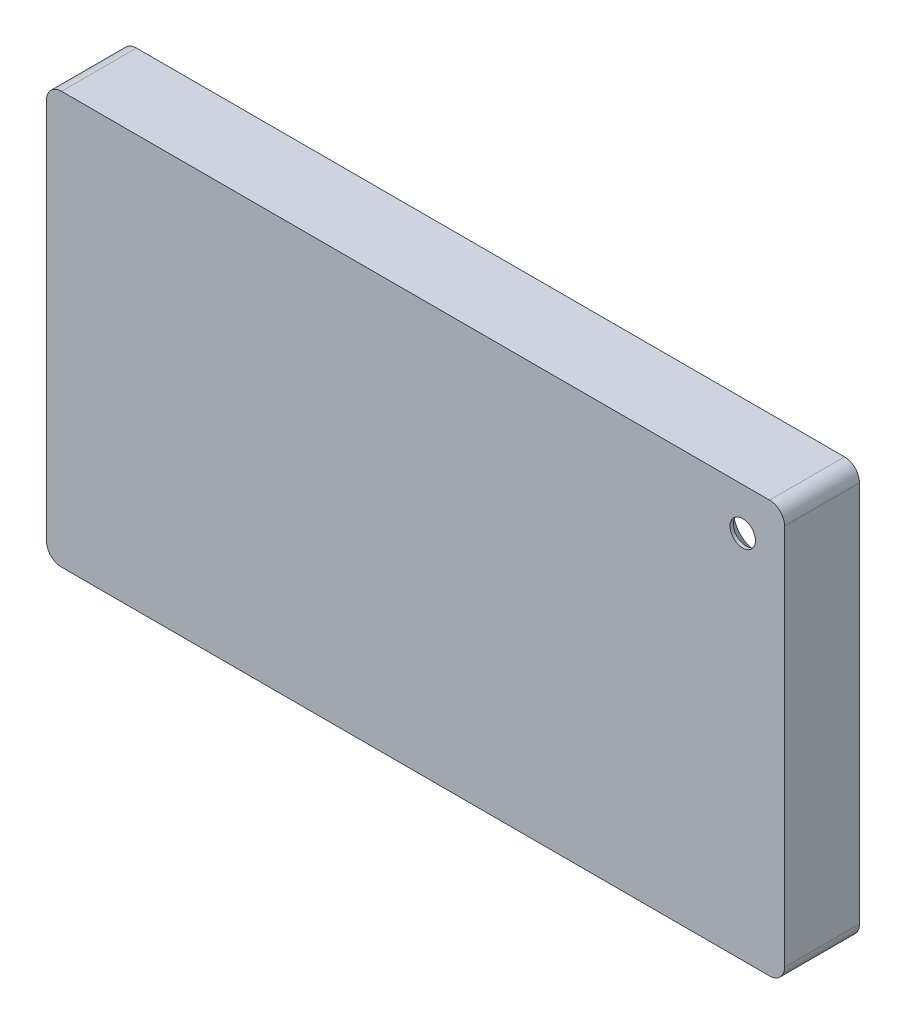
from build123d import *

# Parameters (mm, degrees)
SKETCH1_W           = 94.5
SKETCH1_H           = 51
BOSS_EXTRUDE1_DEPTH = 2
SKETCH2_W           = 98.5
SKETCH2_H           = 55
SKETCH2_W_2         = 94.5
SKETCH2_H_2         = 51
BOSS_EXTRUDE2_DEPTH = 10
SKETCH3_R           = 1.7
CUT_EXTRUDE1_DEPTH  = 58.287105879
CHAMFER1_SIZE       = 1.55
FILLET1_R           = 2
SKETCH7_W           = 0.314102564
SKETCH7_H           = 2.557692308
CUT_EXTRUDE2_DEPTH  = 1


with BuildPart() as part:
    # Sketch1 → Boss-Extrude1 (new body)
    with BuildSketch(Plane.XY):
        Rectangle(SKETCH1_W, SKETCH1_H)
    extrude(amount=BOSS_EXTRUDE1_DEPTH)

    # Sketch2 → Boss-Extrude2 (add)
    with BuildSketch(Plane.XY.offset(2)):
        Rectangle(SKETCH2_W, SKETCH2_H)
        Rectangle(SKETCH2_W_2, SKETCH2_H_2, mode=Mode.SUBTRACT)
    extrude(amount=-BOSS_EXTRUDE2_DEPTH)

    # Sketch3 → Cut-Extrude1 (cut, through all)
    with BuildSketch(Plane.XY.offset(2)):
        with Locations((43.665750405, 21.868338414)):
            Circle(SKETCH3_R)
    extrude(amount=-CUT_EXTRUDE1_DEPTH, mode=Mode.SUBTRACT)

    # Chamfer1
    chamfer1_edges = [part.edges().sort_by_distance(p)[0] for p in [
        (41.965750405, 21.868338414, 0),
    ]]
    chamfer(chamfer1_edges, length=CHAMFER1_SIZE)

    # Fillet1
    fillet1_edges = [part.edges().sort_by_distance(p)[0] for p in [
        (-49.25, 27.5, -3),
        (49.25, 27.5, -3),
        (49.25, -27.5, -3),
        (-49.25, -27.5, -3),
    ]]
    fillet(fillet1_edges, radius=FILLET1_R)

    # Sketch7 → Cut-Extrude2 (cut)
    # profile 1 of 21: a face of its own
    with BuildSketch(Plane(origin=(0, 0, 0), x_dir=(-1, 0, 0), z_dir=(0, 0, -1))):
        Polygon((-39.666506854, -7.047062074), (-38.051122238, -10.547062074), (-38.392568553, -10.547062074), (-38.909996437, -9.425267202), (-40.496635059, -9.425267202), (-41.028786501, -10.547062074), (-41.371635059, -10.547062074), (-39.711378649, -7.047062074), align=None)
        Polygon((-39.69244836, -7.72925358), (-40.326262463, -9.066292843), (-39.075461181, -9.066292843), align=None, mode=Mode.SUBTRACT)
    # profile 2 of 21: a face of its own
    with BuildSketch(Plane(origin=(0, 0, 0), x_dir=(-1, 0, 0), z_dir=(0, 0, -1))):
        with BuildLine():
            Line((-37.60240429, -7.989369766), (-37.288301726, -7.989369766))
            Line((-37.288301726, -7.989369766), (-37.288301726, -8.36587217))
            add(Edge.make_bspline(
                [(-37.288301726, -8.36587217), (-37.265112967, -8.330816341), (-37.220764646, -8.263772342), (-37.147051717, -8.175103041), (-37.071548385, -8.101687994), (-36.993893198, -8.043184476), (-36.913515098, -7.999371357), (-36.832178146, -7.967278322), (-36.748602677, -7.948301007), (-36.692440752, -7.945767348), (-36.664303328, -7.944497971)],
                knots=[0, 0, 0, 0, 1.2804753, 2.448899062, 3.506932113, 4.484331642, 5.4025378, 6.288909075, 7.142734305, 8, 8, 8, 8], degree=3))
            add(Edge.make_bspline(
                [(-36.664303328, -7.944497971), (-36.642477002, -7.945688498), (-36.597567916, -7.948138083), (-36.529585327, -7.965348908), (-36.459541875, -7.992826931), (-36.414399488, -8.018667153), (-36.390865828, -8.032138195)],
                knots=[0, 0, 0, 0, 0.901110191, 1.854092781, 2.881294221, 4, 4, 4, 4], degree=3))
            Line((-36.390865828, -8.032138195), (-36.56334179, -8.304173452))
            add(Edge.make_bspline(
                [(-36.56334179, -8.304173452), (-36.578450811, -8.297433186), (-36.607130625, -8.28463887), (-36.649085192, -8.26949686), (-36.687766528, -8.260580944), (-36.712410087, -8.259230227), (-36.723898681, -8.258600535)],
                knots=[0, 0, 0, 0, 1.180555205, 2.24091978, 3.179933427, 4, 4, 4, 4], degree=3))
            add(Edge.make_bspline(
                [(-36.723898681, -8.258600535), (-36.749104414, -8.260280572), (-36.800516804, -8.263707362), (-36.876001304, -8.290646169), (-36.949248509, -8.33417141), (-37.007420171, -8.382442521), (-37.052462424, -8.428990319), (-37.08460265, -8.469638721), (-37.114085397, -8.515217353), (-37.142255617, -8.564947037), (-37.167921911, -8.619676883), (-37.191876581, -8.678860096), (-37.213535444, -8.742565225), (-37.225885688, -8.786947745), (-37.232211982, -8.809682266)],
                knots=[0, 0, 0, 0, 1.125678352, 2.296057538, 3.5422874, 4.923748041, 5.663163013, 6.437101912, 7.23742474, 8.08941207, 8.991984279, 9.93940061, 10.944477711, 12, 12, 12, 12], degree=3))
            add(Edge.make_bspline(
                [(-37.232211982, -8.809682266), (-37.236944375, -8.829959439), (-37.247426267, -8.874871838), (-37.257617805, -8.950220363), (-37.267687323, -9.039244022), (-37.274783941, -9.142190614), (-37.281361983, -9.258803058), (-37.285072066, -9.389259004), (-37.288175206, -9.533692355), (-37.288258273, -9.634666708), (-37.288301726, -9.687486753)],
                knots=[0, 0, 0, 0, 0.566838948, 1.255505196, 2.06880316, 3.007127437, 4.065329342, 5.249902469, 6.561414163, 8, 8, 8, 8], degree=3))
            Line((-37.288301726, -9.687486753), (-37.288301726, -10.547062074))
            Line((-37.288301726, -10.547062074), (-37.60240429, -10.547062074))
            Line((-37.60240429, -10.547062074), (-37.60240429, -7.989369766))
        make_face()
    # profile 3 of 21: a face of its own
    with BuildSketch(Plane(origin=(0, 0, 0), x_dir=(-1, 0, 0), z_dir=(0, 0, -1))):
        with BuildLine():
            Line((-33.474199162, -6.957318484), (-33.474199162, -10.547062074))
            Line((-33.474199162, -10.547062074), (-33.788301726, -10.547062074))
            Line((-33.788301726, -10.547062074), (-33.788301726, -10.104654221))
            add(Edge.make_bspline(
                [(-33.788301726, -10.104654221), (-33.823720516, -10.144693815), (-33.892840732, -10.222831586), (-34.00828185, -10.324913758), (-34.130650027, -10.40929208), (-34.259351349, -10.477441996), (-34.394269592, -10.528634052), (-34.535105679, -10.565020211), (-34.68191706, -10.588414046), (-34.782169415, -10.590750068), (-34.8329732, -10.591933868)],
                knots=[0, 0, 0, 0, 1.074387032, 2.096679803, 3.090159297, 4.057316773, 5.018401886, 5.985159533, 6.978961417, 8, 8, 8, 8], degree=3))
            add(Edge.make_bspline(
                [(-34.8329732, -10.591933868), (-34.878141154, -10.590707496), (-34.967214359, -10.588289036), (-35.098243436, -10.569526732), (-35.224335685, -10.53939611), (-35.345610258, -10.497495221), (-35.461282403, -10.441914399), (-35.5723425, -10.375373151), (-35.678215192, -10.296132321), (-35.777286731, -10.205544293), (-35.868518731, -10.107149306), (-35.948580004, -10.002203759), (-36.015333084, -9.891161455), (-36.071153165, -9.775428301), (-36.114149509, -9.654113381), (-36.144123143, -9.527636214), (-36.16286359, -9.39614634), (-36.165281051, -9.306606817), (-36.166506854, -9.261204702)],
                knots=[0, 0, 0, 0, 1.033919861, 2.038935746, 3.024066025, 3.998881131, 4.97069526, 5.957263378, 6.95902576, 7.993208707, 9.027059324, 10.027763471, 11.009749337, 11.988697705, 12.965288445, 13.950418724, 14.960734635, 16, 16, 16, 16], degree=3))
            add(Edge.make_bspline(
                [(-36.166506854, -9.261204702), (-36.165253882, -9.216740998), (-36.162776826, -9.128838655), (-36.144323606, -8.999559957), (-36.113292597, -8.875041696), (-36.069744749, -8.755684753), (-36.013902794, -8.641344703), (-35.945974707, -8.531940678), (-35.865955583, -8.42717128), (-35.773703176, -8.329500053), (-35.673768406, -8.239279439), (-35.566859675, -8.160870394), (-35.455636393, -8.093153545), (-35.338373383, -8.039500069), (-35.216806278, -7.996090964), (-35.089852832, -7.966057996), (-34.958041254, -7.948360675), (-34.868550762, -7.945797911), (-34.823157495, -7.944497971)],
                knots=[0, 0, 0, 0, 1.020392517, 2.01726096, 2.990465484, 3.961182959, 4.928053699, 5.906110375, 6.912531644, 7.948652711, 8.985773172, 9.998621852, 10.987621588, 11.969261332, 12.953316658, 13.946091881, 14.958173133, 16, 16, 16, 16], degree=3))
            add(Edge.make_bspline(
                [(-34.823157495, -7.944497971), (-34.770940687, -7.946065067), (-34.668444896, -7.949141102), (-34.518546375, -7.974847469), (-34.376758764, -8.018010347), (-34.242265777, -8.077101628), (-34.115869217, -8.15390238), (-33.996642576, -8.246653828), (-33.886659253, -8.357980974), (-33.821587431, -8.441592547), (-33.788301726, -8.484361753)],
                knots=[0, 0, 0, 0, 1.031072012, 2.023879775, 2.993683497, 3.952812103, 4.918022106, 5.908088563, 6.929940113, 8, 8, 8, 8], degree=3))
            Line((-33.788301726, -8.484361753), (-33.788301726, -6.957318484))
            Line((-33.788301726, -6.957318484), (-33.474199162, -6.957318484))
        make_face()
        with BuildLine():
            add(Edge.make_bspline(
                [(-34.818950764, -8.258600535), (-34.864865102, -8.260234173), (-34.955492702, -8.263458714), (-35.088536704, -8.288632209), (-35.215850118, -8.330516803), (-35.336796192, -8.387798705), (-35.449464409, -8.459827441), (-35.55015808, -8.546948824), (-35.639700781, -8.646785839), (-35.715009045, -8.758887949), (-35.776399542, -8.87906604), (-35.819566574, -9.004690478), (-35.848035822, -9.133495456), (-35.850944342, -9.220858142), (-35.85240429, -9.264710311)],
                knots=[0, 0, 0, 0, 1.031046209, 2.035121221, 3.029706178, 4.034933723, 5.034054252, 6.02443088, 7.017295772, 8.038157696, 9.050218397, 10.03989886, 11.016116709, 12, 12, 12, 12], degree=3))
            add(Edge.make_bspline(
                [(-35.85240429, -9.264710311), (-35.850539396, -9.308300418), (-35.84681692, -9.395309774), (-35.820066225, -9.524290351), (-35.775186352, -9.649944393), (-35.713944289, -9.771205386), (-35.637257664, -9.883789486), (-35.548369012, -9.985529609), (-35.44641873, -10.073019197), (-35.333491223, -10.146256771), (-35.212883253, -10.205419292), (-35.086049321, -10.246584931), (-34.955373683, -10.273162712), (-34.866521349, -10.276267189), (-34.821755251, -10.277831304)],
                knots=[0, 0, 0, 0, 0.979072187, 1.954306742, 2.945804271, 3.96968567, 4.997920485, 5.998718438, 6.996577872, 8.005894225, 9.015743152, 10.005417472, 10.995077863, 12, 12, 12, 12], degree=3))
            add(Edge.make_bspline(
                [(-34.821755251, -10.277831304), (-34.776308749, -10.27617134), (-34.685920162, -10.272869837), (-34.552481454, -10.247588571), (-34.422986491, -10.205819773), (-34.299199263, -10.147920646), (-34.183883132, -10.07616329), (-34.080385254, -9.992156199), (-33.992869286, -9.894453015), (-33.918676676, -9.787076562), (-33.86050126, -9.669364566), (-33.8181252, -9.544030375), (-33.793071295, -9.411069627), (-33.789913565, -9.3202057), (-33.788301726, -9.273824894)],
                knots=[0, 0, 0, 0, 1.01762866, 2.023962475, 3.030623092, 4.058876274, 5.077231937, 6.066672613, 7.034107872, 8.005628644, 8.981990164, 9.965428785, 10.961468474, 12, 12, 12, 12], degree=3))
            add(Edge.make_bspline(
                [(-33.788301726, -9.273824894), (-33.789261382, -9.238487064), (-33.791150289, -9.16893103), (-33.805580859, -9.066803513), (-33.828535785, -8.969069787), (-33.860881955, -8.875627098), (-33.90337324, -8.786992082), (-33.954621006, -8.702528322), (-34.015526455, -8.622675111), (-34.085109152, -8.54853204), (-34.161274354, -8.480905577), (-34.241868895, -8.420541337), (-34.327847642, -8.370952564), (-34.417764679, -8.329911292), (-34.511776013, -8.297252142), (-34.610646633, -8.275464449), (-34.71332562, -8.260504128), (-34.783371675, -8.259241747), (-34.818950764, -8.258600535)],
                knots=[0, 0, 0, 0, 1.050140795, 2.067009409, 3.05949893, 4.030605086, 5.00011959, 5.97591094, 6.962425594, 7.979863591, 8.993523472, 9.986985069, 10.967611495, 11.937549037, 12.921786183, 13.919465291, 14.943216303, 16, 16, 16, 16], degree=3))
        make_face(mode=Mode.SUBTRACT)
    # profile 4 of 21: a face of its own
    with BuildSketch(Plane(origin=(0, 0, 0), x_dir=(-1, 0, 0), z_dir=(0, 0, -1))):
        with BuildLine():
            Line((-32.801122238, -7.989369766), (-32.487019674, -7.989369766))
            Line((-32.487019674, -7.989369766), (-32.487019674, -9.175667843))
            add(Edge.make_bspline(
                [(-32.487019674, -9.175667843), (-32.486877769, -9.210490592), (-32.486606312, -9.27710488), (-32.484765371, -9.372960067), (-32.480435277, -9.460376779), (-32.475021453, -9.539405516), (-32.468059317, -9.610032908), (-32.459775956, -9.672012265), (-32.450517535, -9.726046449), (-32.441454821, -9.758589805), (-32.437240027, -9.773724734)],
                knots=[0, 0, 0, 0, 1.388932606, 2.656963016, 3.823490214, 4.879454478, 5.816252168, 6.653371382, 7.373723809, 8, 8, 8, 8], degree=3))
            add(Edge.make_bspline(
                [(-32.437240027, -9.773724734), (-32.430478572, -9.792747605), (-32.417096231, -9.830397866), (-32.392822747, -9.884786871), (-32.362794411, -9.935162153), (-32.329934583, -9.983466226), (-32.292035175, -10.028268213), (-32.249575704, -10.069492457), (-32.203977467, -10.108696548), (-32.136222444, -10.15508134), (-32.043563178, -10.20479667), (-31.921910422, -10.247692488), (-31.790006196, -10.273328308), (-31.698841477, -10.276302563), (-31.651983617, -10.277831304)],
                knots=[0, 0, 0, 0, 0.725840625, 1.436591201, 2.137033971, 2.831655856, 3.53531722, 4.242432219, 4.957935707, 5.694543706, 7.190802206, 8.724350549, 10.316345118, 12, 12, 12, 12], degree=3))
            add(Edge.make_bspline(
                [(-31.651983617, -10.277831304), (-31.605130109, -10.276270056), (-31.514477241, -10.273249329), (-31.384022271, -10.24846579), (-31.264770857, -10.207060101), (-31.157919906, -10.149252689), (-31.063954065, -10.078510626), (-30.985649647, -9.995501818), (-30.921042392, -9.902852431), (-30.892832972, -9.833728152), (-30.878646277, -9.798965118)],
                knots=[0, 0, 0, 0, 1.157059328, 2.238695713, 3.266970494, 4.264342957, 5.228770407, 6.160125903, 7.074715775, 8, 8, 8, 8], degree=3))
            add(Edge.make_bspline(
                [(-30.878646277, -9.798965118), (-30.874452047, -9.78499882), (-30.865179628, -9.754122744), (-30.855217277, -9.701742996), (-30.846242815, -9.639278391), (-30.838579639, -9.566320183), (-30.833114477, -9.48305903), (-30.83016845, -9.389520954), (-30.826840175, -9.285999594), (-30.826789659, -9.213531835), (-30.826763264, -9.175667843)],
                knots=[0, 0, 0, 0, 0.557542046, 1.232589297, 2.036731608, 2.971723315, 4.038036528, 5.22795436, 6.551621927, 8, 8, 8, 8], degree=3))
            Line((-30.826763264, -9.175667843), (-30.826763264, -7.989369766))
            Line((-30.826763264, -7.989369766), (-30.5126607, -7.989369766))
            Line((-30.5126607, -7.989369766), (-30.5126607, -9.234562074))
            add(Edge.make_bspline(
                [(-30.5126607, -9.234562074), (-30.513102395, -9.276869245), (-30.513959343, -9.358950945), (-30.519466687, -9.478235056), (-30.528916299, -9.589397301), (-30.543258984, -9.692496521), (-30.560124659, -9.787454003), (-30.581880932, -9.874391449), (-30.60785917, -9.953041003), (-30.637164685, -10.02478278), (-30.671786552, -10.089829674), (-30.708613573, -10.15156549), (-30.751138344, -10.208458426), (-30.795908579, -10.263340563), (-30.845710235, -10.31348209), (-30.899610094, -10.360033566), (-30.956849513, -10.403706598), (-31.018698711, -10.442797877), (-31.084254774, -10.478014523), (-31.153598631, -10.509230601), (-31.22757963, -10.533933178), (-31.305243267, -10.555243844), (-31.386970046, -10.571958313), (-31.472681179, -10.583744879), (-31.562347795, -10.59097021), (-31.623457255, -10.591607255), (-31.654788104, -10.591933868)],
                knots=[0, 0, 0, 0, 1.493040784, 2.896703357, 4.213163133, 5.428574705, 6.569057535, 7.615249723, 8.588095153, 9.490268104, 10.346124644, 11.18633936, 12.024365274, 12.850166724, 13.684164916, 14.514361689, 15.362232829, 16.222528818, 17.093394965, 17.986930858, 18.902426812, 19.842810585, 20.827885679, 21.843828298, 22.894529745, 24, 24, 24, 24], degree=3))
            add(Edge.make_bspline(
                [(-31.654788104, -10.591933868), (-31.685884618, -10.591594161), (-31.746992163, -10.590926605), (-31.836663407, -10.583784797), (-31.922612014, -10.571976627), (-32.004532412, -10.555121409), (-32.082506809, -10.534082339), (-32.156851049, -10.509078804), (-32.226694612, -10.477998322), (-32.292876616, -10.443020765), (-32.354879004, -10.403455489), (-32.412987583, -10.36008745), (-32.467124435, -10.312981387), (-32.517301503, -10.262334029), (-32.56281448, -10.207517093), (-32.604230521, -10.148971533), (-32.642187227, -10.087277444), (-32.676540017, -10.021214282), (-32.706051772, -9.948642272), (-32.732107018, -9.868345175), (-32.753417657, -9.779442658), (-32.770760125, -9.68201073), (-32.784711566, -9.576515688), (-32.794397708, -9.462347273), (-32.799813539, -9.339783581), (-32.8006766, -9.255133691), (-32.801122238, -9.211425054)],
                knots=[0, 0, 0, 0, 1.083640291, 2.129454052, 3.13281866, 4.105697902, 5.042300162, 5.946461698, 6.836384745, 7.703652036, 8.553297018, 9.397182691, 10.228592656, 11.052265423, 11.879314572, 12.708807002, 13.549817954, 14.402308542, 15.300838682, 16.27712199, 17.341985831, 18.484375296, 19.725102775, 21.0496083, 22.476576903, 24, 24, 24, 24], degree=3))
            Line((-32.801122238, -9.211425054), (-32.801122238, -7.989369766))
        make_face()
    # profile 5 of 21: a face of its own
    with BuildSketch(Plane(origin=(0, 0, 0), x_dir=(-1, 0, 0), z_dir=(0, 0, -1))):
        with BuildLine():
            add(Edge.make_bspline(
                [(-29.683934738, -6.912446689), (-29.664443423, -6.913350841), (-29.626275683, -6.915121345), (-29.571082415, -6.930282822), (-29.520825403, -6.955982508), (-29.47624767, -6.990462189), (-29.437995783, -7.031011632), (-29.411215073, -7.078272601), (-29.394002677, -7.129331239), (-29.391924122, -7.164946328), (-29.390865828, -7.183079702)],
                knots=[0, 0, 0, 0, 1.055194115, 2.066272739, 3.074728998, 4.095836921, 5.109056067, 6.073838105, 7.019297344, 8, 8, 8, 8], degree=3))
            add(Edge.make_bspline(
                [(-29.390865828, -7.183079702), (-29.391947988, -7.200742355), (-29.39408729, -7.23565933), (-29.411201778, -7.285832802), (-29.438224016, -7.332437085), (-29.476223142, -7.372907796), (-29.520831903, -7.407368416), (-29.571080688, -7.433073155), (-29.626276137, -7.448233292), (-29.664443576, -7.450003981), (-29.683934738, -7.450908227)],
                knots=[0, 0, 0, 0, 0.96129708, 1.900370562, 2.859976407, 3.87933698, 4.906634145, 5.921202961, 6.938410037, 8, 8, 8, 8], degree=3))
            add(Edge.make_bspline(
                [(-29.683934738, -7.450908227), (-29.703203014, -7.450038507), (-29.740706194, -7.44834571), (-29.795073036, -7.432775693), (-29.844901526, -7.40735962), (-29.889566198, -7.373133434), (-29.926796391, -7.332188537), (-29.953894717, -7.285861243), (-29.970969679, -7.235652089), (-29.973114307, -7.200739922), (-29.974199162, -7.183079702)],
                knots=[0, 0, 0, 0, 1.054934014, 2.053291228, 3.073705704, 4.106921865, 5.123545215, 6.088680038, 7.033164197, 8, 8, 8, 8], degree=3))
            add(Edge.make_bspline(
                [(-29.974199162, -7.183079702), (-29.973138075, -7.164948852), (-29.971054034, -7.12933872), (-29.953881918, -7.078243687), (-29.92702211, -7.031262185), (-29.889541546, -6.990236685), (-29.844908086, -6.955991251), (-29.795071341, -6.930580269), (-29.740706642, -6.91500893), (-29.703203166, -6.913316315), (-29.683934738, -6.912446689)],
                knots=[0, 0, 0, 0, 0.98631895, 1.937192651, 2.907499808, 3.917963147, 4.944918757, 5.95915025, 6.951458133, 8, 8, 8, 8], degree=3))
        make_face()
    # profile 6 of 21: a face of its own
    with BuildSketch(Plane(origin=(0, 0, 0), x_dir=(-1, 0, 0), z_dir=(0, 0, -1))):
        with Locations((-29.682532495, -9.26821592)):
            Rectangle(SKETCH7_W, SKETCH7_H)
    # profile 7 of 21: a face of its own
    with BuildSketch(Plane(origin=(0, 0, 0), x_dir=(-1, 0, 0), z_dir=(0, 0, -1))):
        with BuildLine():
            Line((-28.7626607, -7.989369766), (-28.448558136, -7.989369766))
            Line((-28.448558136, -7.989369766), (-28.448558136, -8.450707907))
            add(Edge.make_bspline(
                [(-28.448558136, -8.450707907), (-28.415020501, -8.408865184), (-28.34993955, -8.327667921), (-28.241555216, -8.220947346), (-28.127011316, -8.133002121), (-28.007009313, -8.062898327), (-27.881386303, -8.010051701), (-27.750908033, -7.97188577), (-27.614793326, -7.949000941), (-27.52222889, -7.946010711), (-27.475401085, -7.944497971)],
                knots=[0, 0, 0, 0, 1.12780773, 2.188550248, 3.19190651, 4.159438251, 5.104880172, 6.052711206, 7.014878035, 8, 8, 8, 8], degree=3))
            add(Edge.make_bspline(
                [(-27.475401085, -7.944497971), (-27.42807045, -7.946243166), (-27.335432983, -7.949658935), (-27.200554921, -7.976675626), (-27.074581528, -8.022820881), (-26.957961972, -8.086032951), (-26.852834758, -8.164639425), (-26.760509907, -8.256217207), (-26.68414666, -8.36155329), (-26.632949297, -8.459276446), (-26.599223649, -8.54596524), (-26.577991311, -8.62021199), (-26.55996033, -8.702930142), (-26.544328582, -8.793869731), (-26.53375147, -8.893667921), (-26.525409179, -9.001915613), (-26.519430484, -9.118577744), (-26.519193277, -9.199264371), (-26.519070956, -9.24087217)],
                knots=[0, 0, 0, 0, 1.235846778, 2.418850247, 3.575807741, 4.728682307, 5.871620074, 6.994088408, 8.11269785, 9.256955736, 9.865816715, 10.540099792, 11.271859618, 12.076849838, 12.949306005, 13.892391288, 14.913166135, 16, 16, 16, 16], degree=3))
            Line((-26.519070956, -9.24087217), (-26.519070956, -10.547062074))
            Line((-26.519070956, -10.547062074), (-26.83317352, -10.547062074))
            Line((-26.83317352, -10.547062074), (-26.83317352, -9.343937074))
            add(Edge.make_bspline(
                [(-26.83317352, -9.343937074), (-26.833366729, -9.309114629), (-26.833736303, -9.242505218), (-26.834901949, -9.147136195), (-26.837711756, -9.060649616), (-26.841660069, -8.983252249), (-26.847439099, -8.915018412), (-26.853461731, -8.855809136), (-26.860826707, -8.805699593), (-26.867389621, -8.775534511), (-26.870332976, -8.762005984)],
                knots=[0, 0, 0, 0, 1.430800155, 2.736877192, 3.918605307, 4.986035426, 5.920637409, 6.731861385, 7.431261377, 8, 8, 8, 8], degree=3))
            add(Edge.make_bspline(
                [(-26.870332976, -8.762005984), (-26.880958507, -8.722294799), (-26.901409368, -8.645863054), (-26.951943351, -8.542188702), (-27.015757532, -8.453990514), (-27.093655381, -8.381813792), (-27.184884457, -8.325642955), (-27.289191599, -8.286669001), (-27.40557024, -8.262292732), (-27.487424623, -8.259865599), (-27.530088585, -8.258600535)],
                knots=[0, 0, 0, 0, 1.084156227, 2.086665306, 3.027808233, 3.945421172, 4.874247719, 5.839848303, 6.874090471, 8, 8, 8, 8], degree=3))
            add(Edge.make_bspline(
                [(-27.530088585, -8.258600535), (-27.555356268, -8.25907654), (-27.605360361, -8.260018541), (-27.679510333, -8.269469839), (-27.751434506, -8.284928294), (-27.821854715, -8.305796932), (-27.889362509, -8.334459201), (-27.9561268, -8.366988571), (-28.019633564, -8.407536783), (-28.081236961, -8.452727405), (-28.138549769, -8.502806612), (-28.191878108, -8.555651122), (-28.239416128, -8.611926726), (-28.282484803, -8.670726673), (-28.319663066, -8.732858511), (-28.352116154, -8.797722818), (-28.379651849, -8.865404967), (-28.393334542, -8.912380028), (-28.400180732, -8.935884189)],
                knots=[0, 0, 0, 0, 1.023777757, 2.026029729, 3.023749952, 4.003683103, 4.997618607, 5.993177895, 7.010360494, 8.046726602, 9.087585522, 10.09234134, 11.086953743, 12.070360549, 13.043493632, 14.017870808, 15.008233677, 16, 16, 16, 16], degree=3))
            add(Edge.make_bspline(
                [(-28.400180732, -8.935884189), (-28.404120381, -8.953139392), (-28.412696789, -8.990703066), (-28.421959969, -9.052347486), (-28.430367545, -9.123657461), (-28.437404503, -9.204549778), (-28.44170992, -9.295307653), (-28.446404317, -9.395543491), (-28.448113378, -9.505656979), (-28.448405732, -9.582318672), (-28.448558136, -9.622282426)],
                knots=[0, 0, 0, 0, 0.615963638, 1.340920617, 2.168419149, 3.115676021, 4.16674242, 5.331190069, 6.6087489, 8, 8, 8, 8], degree=3))
            Line((-28.448558136, -9.622282426), (-28.448558136, -10.547062074))
            Line((-28.448558136, -10.547062074), (-28.7626607, -10.547062074))
            Line((-28.7626607, -10.547062074), (-28.7626607, -7.989369766))
        make_face()
    # profile 8 of 21: a face of its own
    with BuildSketch(Plane(origin=(0, 0, 0), x_dir=(-1, 0, 0), z_dir=(0, 0, -1))):
        with BuildLine():
            add(Edge.make_bspline(
                [(-24.565745636, -7.944497971), (-24.517754363, -7.945519862), (-24.423655205, -7.947523541), (-24.28584732, -7.968938507), (-24.154302184, -8.001685871), (-24.028515991, -8.046957433), (-23.910099696, -8.107639384), (-23.797328452, -8.180048675), (-23.690511443, -8.265831268), (-23.626488414, -8.332189337), (-23.593990828, -8.36587217)],
                knots=[0, 0, 0, 0, 1.054011418, 2.066658804, 3.057071809, 4.030435133, 4.997543892, 5.974964718, 6.972108034, 8, 8, 8, 8], degree=3))
            add(Edge.make_bspline(
                [(-23.593990828, -8.36587217), (-23.566008874, -8.398086155), (-23.510586494, -8.461890698), (-23.439520775, -8.565346311), (-23.378299215, -8.672486411), (-23.329236254, -8.784733738), (-23.29055123, -8.901108409), (-23.263085534, -9.02201042), (-23.246748599, -9.147172767), (-23.244545632, -9.232176605), (-23.243429931, -9.275227138)],
                knots=[0, 0, 0, 0, 1.025258237, 2.030674902, 3.01204498, 3.988269485, 4.97094183, 5.956517959, 6.965070386, 8, 8, 8, 8], degree=3))
            add(Edge.make_bspline(
                [(-23.243429931, -9.275227138), (-23.244411268, -9.318527195), (-23.246350436, -9.404090129), (-23.264694053, -9.530109494), (-23.293225139, -9.652304317), (-23.334056977, -9.770163011), (-23.386415086, -9.884045838), (-23.450305774, -9.993455388), (-23.526177391, -10.098607521), (-23.612181388, -10.198609359), (-23.707233264, -10.290775574), (-23.810349412, -10.371103843), (-23.919503446, -10.439925368), (-24.036146799, -10.495361783), (-24.159214286, -10.539071484), (-24.288971354, -10.5697715), (-24.425216424, -10.588333184), (-24.518243646, -10.590716757), (-24.565745636, -10.591933868)],
                knots=[0, 0, 0, 0, 0.998656419, 1.973391657, 2.932242238, 3.890759089, 4.846373663, 5.82037756, 6.809684879, 7.83454468, 8.860553229, 9.859544525, 10.845671541, 11.83227036, 12.833544569, 13.85385346, 14.904124723, 16, 16, 16, 16], degree=3))
            add(Edge.make_bspline(
                [(-24.565745636, -10.591933868), (-24.613480355, -10.590712672), (-24.706971215, -10.588320898), (-24.843697197, -10.569843615), (-24.973686816, -10.539085632), (-25.096915414, -10.49521814), (-25.214060261, -10.439923596), (-25.323846758, -10.371311906), (-25.427046674, -10.290751751), (-25.522118658, -10.198615814), (-25.608117264, -10.098605858), (-25.683990272, -9.993455819), (-25.747880598, -9.884045726), (-25.800238802, -9.770163041), (-25.841070615, -9.652304309), (-25.869601708, -9.530109497), (-25.887945322, -9.404090128), (-25.889884491, -9.318527195), (-25.890865828, -9.275227138)],
                knots=[0, 0, 0, 0, 1.099876186, 2.154163076, 3.173186993, 4.173200201, 5.163417411, 6.152872554, 7.150605724, 8.17532212, 9.198891216, 10.186952605, 11.159729845, 12.11414092, 13.071450619, 14.029093627, 15.002601286, 16, 16, 16, 16], degree=3))
            add(Edge.make_bspline(
                [(-25.890865828, -9.275227138), (-25.889742518, -9.232410592), (-25.887518556, -9.147641189), (-25.871198047, -9.022714129), (-25.843839491, -8.90201674), (-25.805108094, -8.786091264), (-25.755592903, -8.674335828), (-25.695231616, -8.566930997), (-25.623440983, -8.463943196), (-25.568239031, -8.400221116), (-25.540304931, -8.367975535)],
                knots=[0, 0, 0, 0, 1.031353054, 2.041901799, 3.029428768, 4.008703097, 4.981709435, 5.96992636, 6.972712378, 8, 8, 8, 8], degree=3))
            add(Edge.make_bspline(
                [(-25.540304931, -8.367975535), (-25.50785634, -8.334000596), (-25.444040476, -8.2671829), (-25.336691748, -8.181650376), (-25.224197927, -8.107734302), (-25.104473001, -8.048258086), (-24.978790143, -8.001419568), (-24.8465709, -7.968854053), (-24.708295385, -7.947600698), (-24.613735764, -7.945542521), (-24.565745636, -7.944497971)],
                knots=[0, 0, 0, 0, 1.027980169, 2.021703884, 2.998553061, 3.971491411, 4.943284454, 5.930300938, 6.949603206, 8, 8, 8, 8], degree=3))
        make_face()
        with BuildLine():
            add(Edge.make_bspline(
                [(-24.567147879, -8.258600535), (-24.601085491, -8.259565127), (-24.668084619, -8.261469409), (-24.766704204, -8.275953314), (-24.861644358, -8.298900818), (-24.953085202, -8.331504874), (-25.040718375, -8.373603773), (-25.124627777, -8.425312133), (-25.205060217, -8.48594509), (-25.28044228, -8.555407762), (-25.349624592, -8.631286756), (-25.410102569, -8.712135115), (-25.461527675, -8.796641461), (-25.504367834, -8.884893672), (-25.536275022, -8.977786086), (-25.559448045, -9.074266718), (-25.573918285, -9.174532134), (-25.575804664, -9.242693152), (-25.576763264, -9.277330503)],
                knots=[0, 0, 0, 0, 1.021534396, 2.016698045, 2.994645724, 3.958388632, 4.93408049, 5.916473867, 6.921342795, 7.962252576, 8.998418191, 10.008913653, 10.997312074, 11.973003931, 12.956656626, 13.948281152, 14.957379055, 16, 16, 16, 16], degree=3))
            add(Edge.make_bspline(
                [(-25.576763264, -9.277330503), (-25.57515644, -9.32208253), (-25.571967196, -9.410906936), (-25.54603196, -9.541718058), (-25.50264568, -9.66729991), (-25.4440584, -9.786916296), (-25.370652181, -9.897588575), (-25.284165115, -9.996260059), (-25.185525414, -10.08144587), (-25.075908914, -10.152126716), (-24.957554596, -10.208286472), (-24.832298275, -10.248085447), (-24.701657581, -10.27395714), (-24.61237685, -10.276528614), (-24.567147879, -10.277831304)],
                knots=[0, 0, 0, 0, 1.016792936, 2.018143844, 3.017858371, 4.030088057, 5.03801393, 6.028138512, 7.003788237, 7.991172063, 8.984598303, 9.972568034, 10.972917682, 12, 12, 12, 12], degree=3))
            add(Edge.make_bspline(
                [(-24.567147879, -10.277831304), (-24.521921511, -10.276521024), (-24.432645915, -10.273934567), (-24.302186738, -10.248215747), (-24.177272766, -10.208112087), (-24.059041378, -10.152189877), (-23.949474775, -10.081177462), (-23.850125654, -9.996741085), (-23.764377042, -9.897327234), (-23.691043438, -9.786769705), (-23.631496695, -9.667485353), (-23.588313493, -9.54169488), (-23.562315907, -9.410912839), (-23.559135078, -9.322084508), (-23.557532495, -9.277330503)],
                knots=[0, 0, 0, 0, 1.02726834, 2.027799167, 3.010890988, 4.004497153, 4.992059811, 5.971914811, 6.958719428, 7.966827853, 8.981595046, 9.981490638, 10.983022906, 12, 12, 12, 12], degree=3))
            add(Edge.make_bspline(
                [(-23.557532495, -9.277330503), (-23.558490765, -9.242692945), (-23.560376494, -9.17453152), (-23.574851458, -9.074269066), (-23.598006998, -8.977777469), (-23.629978615, -8.884925466), (-23.672632629, -8.796412962), (-23.725049422, -8.712383235), (-23.785280448, -8.631006689), (-23.855297569, -8.555653048), (-23.930600946, -8.485918011), (-24.011065985, -8.425288622), (-24.094850963, -8.373831026), (-24.182229546, -8.331144786), (-24.273682113, -8.299197446), (-24.368489243, -8.275820814), (-24.466688053, -8.261530617), (-24.533447096, -8.259583476), (-24.567147879, -8.258600535)],
                knots=[0, 0, 0, 0, 1.042956736, 2.052379634, 3.044323526, 4.02829302, 5.004299113, 5.996692471, 7.007513377, 8.048758398, 9.090003419, 10.095195979, 11.07790575, 12.047570684, 13.018257071, 13.989683339, 14.985167495, 16, 16, 16, 16], degree=3))
        make_face(mode=Mode.SUBTRACT)
    # profile 9 of 21: a face of its own
    with BuildSketch(Plane(origin=(0, 0, 0), x_dir=(-1, 0, 0), z_dir=(0, 0, -1))):
        Polygon((-38.410096597, -17.380395407), (-38.410096597, -13.880395407), (-38.344191149, -13.880395407), (-36.031891469, -16.635102939), (-36.031891469, -13.880395407), (-35.717788905, -13.880395407), (-35.717788905, -17.380395407), (-35.789303328, -17.380395407), (-38.095994033, -14.631997971), (-38.095994033, -17.380395407), align=None)
    # profile 10 of 21: a face of its own
    with BuildSketch(Plane(origin=(0, 0, 0), x_dir=(-1, 0, 0), z_dir=(0, 0, -1))):
        with BuildLine():
            Line((-32.307532495, -14.822703099), (-32.307532495, -17.380395407))
            Line((-32.307532495, -17.380395407), (-32.621635059, -17.380395407))
            Line((-32.621635059, -17.380395407), (-32.621635059, -16.937987554))
            add(Edge.make_bspline(
                [(-32.621635059, -16.937987554), (-32.65705385, -16.978027148), (-32.726174065, -17.056164919), (-32.841615183, -17.158247092), (-32.963983361, -17.242625413), (-33.092684682, -17.310775329), (-33.227602925, -17.361967385), (-33.368439012, -17.398353545), (-33.515250393, -17.42174738), (-33.615502748, -17.424083402), (-33.666306533, -17.425267202)],
                knots=[0, 0, 0, 0, 1.074387032, 2.096679803, 3.090159297, 4.057316773, 5.018401886, 5.985159533, 6.978961417, 8, 8, 8, 8], degree=3))
            add(Edge.make_bspline(
                [(-33.666306533, -17.425267202), (-33.711474487, -17.424040829), (-33.800547692, -17.421622369), (-33.931576769, -17.402860065), (-34.057669019, -17.372729444), (-34.178943591, -17.330828554), (-34.294615737, -17.275247733), (-34.405675833, -17.208706485), (-34.511548525, -17.129465655), (-34.610620064, -17.038877626), (-34.701852065, -16.940482639), (-34.781913337, -16.835537092), (-34.848666417, -16.724494788), (-34.904486498, -16.608761634), (-34.947482842, -16.487446715), (-34.977456477, -16.360969547), (-34.996196923, -16.229479673), (-34.998614384, -16.13994015), (-34.999840187, -16.094538035)],
                knots=[0, 0, 0, 0, 1.033919861, 2.038935746, 3.024066025, 3.998881131, 4.97069526, 5.957263378, 6.95902576, 7.993208707, 9.027059324, 10.027763471, 11.009749337, 11.988697705, 12.965288445, 13.950418724, 14.960734635, 16, 16, 16, 16], degree=3))
            add(Edge.make_bspline(
                [(-34.999840187, -16.094538035), (-34.998587216, -16.050074331), (-34.996110159, -15.962171988), (-34.977656939, -15.83289329), (-34.94662593, -15.708375029), (-34.903078083, -15.589018086), (-34.847236128, -15.474678036), (-34.779308041, -15.365274011), (-34.699288916, -15.260504614), (-34.607036509, -15.162833387), (-34.507101739, -15.072612773), (-34.400193008, -14.994203727), (-34.288969727, -14.926486878), (-34.171706716, -14.872833402), (-34.050139611, -14.829424297), (-33.923186166, -14.799391329), (-33.791374587, -14.781694008), (-33.701884095, -14.779131244), (-33.656490828, -14.777831304)],
                knots=[0, 0, 0, 0, 1.020392517, 2.01726096, 2.990465484, 3.961182959, 4.928053699, 5.906110375, 6.912531644, 7.948652711, 8.985773172, 9.998621852, 10.987621588, 11.969261332, 12.953316658, 13.946091881, 14.958173133, 16, 16, 16, 16], degree=3))
            add(Edge.make_bspline(
                [(-33.656490828, -14.777831304), (-33.604290969, -14.779269056), (-33.501929509, -14.782088419), (-33.3522015, -14.805551146), (-33.210557022, -14.845189613), (-33.07590267, -14.899107111), (-32.948721984, -14.97075584), (-32.830219, -15.061135801), (-32.719153516, -15.169676988), (-32.654773225, -15.253047433), (-32.621635059, -15.295960311)],
                knots=[0, 0, 0, 0, 1.038897134, 2.037228247, 3.008116434, 3.962042015, 4.918381754, 5.904844433, 6.921570401, 8, 8, 8, 8], degree=3))
            Line((-32.621635059, -15.295960311), (-32.621635059, -14.822703099))
            Line((-32.621635059, -14.822703099), (-32.307532495, -14.822703099))
        make_face()
        with BuildLine():
            add(Edge.make_bspline(
                [(-33.652284097, -15.091933868), (-33.698198435, -15.093567506), (-33.788826035, -15.096792047), (-33.921870037, -15.121965542), (-34.049183451, -15.163850137), (-34.170129526, -15.221132038), (-34.282797742, -15.293160775), (-34.383491413, -15.380282158), (-34.473034114, -15.480119172), (-34.548342379, -15.592221282), (-34.609732876, -15.712399373), (-34.652899908, -15.838023812), (-34.681369155, -15.966828789), (-34.684277676, -16.054191475), (-34.685737623, -16.098043644)],
                knots=[0, 0, 0, 0, 1.031046209, 2.035121221, 3.029706178, 4.034933723, 5.034054252, 6.02443088, 7.017295772, 8.038157696, 9.050218397, 10.03989886, 11.016116709, 12, 12, 12, 12], degree=3))
            add(Edge.make_bspline(
                [(-34.685737623, -16.098043644), (-34.68387273, -16.141633751), (-34.680150253, -16.228643107), (-34.653399558, -16.357623684), (-34.608519685, -16.483277726), (-34.547277622, -16.604538719), (-34.470590998, -16.71712282), (-34.381702345, -16.818862942), (-34.279752064, -16.906352531), (-34.166824557, -16.979590104), (-34.046216586, -17.038752625), (-33.919382655, -17.079918265), (-33.788707017, -17.106496045), (-33.699854683, -17.109600522), (-33.655088585, -17.111164638)],
                knots=[0, 0, 0, 0, 0.979072187, 1.954306742, 2.945804271, 3.96968567, 4.997920485, 5.998718438, 6.996577872, 8.005894225, 9.015743152, 10.005417472, 10.995077863, 12, 12, 12, 12], degree=3))
            add(Edge.make_bspline(
                [(-33.655088585, -17.111164638), (-33.609642082, -17.109504674), (-33.519253495, -17.10620317), (-33.385814787, -17.080921905), (-33.256319825, -17.039153106), (-33.132532596, -16.98125398), (-33.017216465, -16.909496624), (-32.913718587, -16.825489533), (-32.826202619, -16.727786349), (-32.75201001, -16.620409896), (-32.693834593, -16.502697899), (-32.651458534, -16.377363708), (-32.626404628, -16.24440296), (-32.623246898, -16.153539033), (-32.621635059, -16.107158227)],
                knots=[0, 0, 0, 0, 1.01762866, 2.023962475, 3.030623092, 4.058876274, 5.077231937, 6.066672613, 7.034107872, 8.005628644, 8.981990164, 9.965428785, 10.961468474, 12, 12, 12, 12], degree=3))
            add(Edge.make_bspline(
                [(-32.621635059, -16.107158227), (-32.622594715, -16.071820397), (-32.624483623, -16.002264364), (-32.638914192, -15.900136846), (-32.661869119, -15.80240312), (-32.694215289, -15.708960431), (-32.736706573, -15.620325415), (-32.787954339, -15.535861655), (-32.848859789, -15.456008444), (-32.918442485, -15.381865373), (-32.994607687, -15.314238911), (-33.075202228, -15.25387467), (-33.161180975, -15.204285897), (-33.251098012, -15.163244626), (-33.345109346, -15.130585476), (-33.443979966, -15.108797782), (-33.546658953, -15.093837461), (-33.616705009, -15.09257508), (-33.652284097, -15.091933868)],
                knots=[0, 0, 0, 0, 1.050140795, 2.067009409, 3.05949893, 4.030605086, 5.00011959, 5.97591094, 6.962425594, 7.979863591, 8.993523472, 9.986985069, 10.967611495, 11.937549037, 12.921786183, 13.919465291, 14.943216303, 16, 16, 16, 16], degree=3))
        make_face(mode=Mode.SUBTRACT)
    # profile 11 of 21: a face of its own
    with BuildSketch(Plane(origin=(0, 0, 0), x_dir=(-1, 0, 0), z_dir=(0, 0, -1))):
        with BuildLine():
            Line((-31.589583777, -14.822703099), (-31.275481213, -14.822703099))
            Line((-31.275481213, -14.822703099), (-31.275481213, -15.28404124))
            add(Edge.make_bspline(
                [(-31.275481213, -15.28404124), (-31.241943578, -15.242198517), (-31.176862627, -15.161001254), (-31.068478293, -15.054280679), (-30.953934393, -14.966335454), (-30.83393239, -14.89623166), (-30.708309379, -14.843385034), (-30.577831109, -14.805219103), (-30.441716403, -14.782334275), (-30.349151967, -14.779344044), (-30.302324162, -14.777831304)],
                knots=[0, 0, 0, 0, 1.12780773, 2.188550248, 3.19190651, 4.159438251, 5.104880172, 6.052711206, 7.014878035, 8, 8, 8, 8], degree=3))
            add(Edge.make_bspline(
                [(-30.302324162, -14.777831304), (-30.254993527, -14.7795765), (-30.16235606, -14.782992268), (-30.027477998, -14.810008959), (-29.901504605, -14.856154214), (-29.784885049, -14.919366285), (-29.679757835, -14.997972758), (-29.587432984, -15.08955054), (-29.511069737, -15.194886623), (-29.459872374, -15.292609779), (-29.426146726, -15.379298574), (-29.404914388, -15.453545324), (-29.386883407, -15.536263475), (-29.371251659, -15.627203064), (-29.360674547, -15.727001254), (-29.352332255, -15.835248946), (-29.346353561, -15.951911077), (-29.346116354, -16.032597704), (-29.345994033, -16.074205503)],
                knots=[0, 0, 0, 0, 1.235846778, 2.418850247, 3.575807741, 4.728682307, 5.871620074, 6.994088408, 8.11269785, 9.256955736, 9.865816715, 10.540099792, 11.271859618, 12.076849838, 12.949306005, 13.892391288, 14.913166135, 16, 16, 16, 16], degree=3))
            Line((-29.345994033, -16.074205503), (-29.345994033, -17.380395407))
            Line((-29.345994033, -17.380395407), (-29.660096597, -17.380395407))
            Line((-29.660096597, -17.380395407), (-29.660096597, -16.177270407))
            add(Edge.make_bspline(
                [(-29.660096597, -16.177270407), (-29.660289805, -16.142447962), (-29.660659379, -16.075838551), (-29.661825026, -15.980469528), (-29.664634833, -15.89398295), (-29.668583146, -15.816585582), (-29.674362176, -15.748351746), (-29.680384808, -15.689142469), (-29.687749784, -15.639032926), (-29.694312698, -15.608867844), (-29.697256053, -15.595339317)],
                knots=[0, 0, 0, 0, 1.430800155, 2.736877192, 3.918605307, 4.986035426, 5.920637409, 6.731861385, 7.431261377, 8, 8, 8, 8], degree=3))
            add(Edge.make_bspline(
                [(-29.697256053, -15.595339317), (-29.707881584, -15.555628132), (-29.728332445, -15.479196388), (-29.778866428, -15.375522035), (-29.842680609, -15.287323847), (-29.920578458, -15.215147125), (-30.011807534, -15.158976289), (-30.116114676, -15.120002334), (-30.232493317, -15.095626065), (-30.3143477, -15.093198933), (-30.357011662, -15.091933868)],
                knots=[0, 0, 0, 0, 1.084156227, 2.086665306, 3.027808233, 3.945421172, 4.874247719, 5.839848303, 6.874090471, 8, 8, 8, 8], degree=3))
            add(Edge.make_bspline(
                [(-30.357011662, -15.091933868), (-30.382279345, -15.092409873), (-30.432283438, -15.093351874), (-30.50643341, -15.102803172), (-30.578357583, -15.118261628), (-30.648777792, -15.139130265), (-30.716285586, -15.167792534), (-30.783049877, -15.200321905), (-30.846556641, -15.240870117), (-30.908160038, -15.286060738), (-30.965472846, -15.336139945), (-31.018801184, -15.388984455), (-31.066339205, -15.445260059), (-31.10940788, -15.504060007), (-31.146586143, -15.566191845), (-31.179039231, -15.631056151), (-31.206574926, -15.6987383), (-31.220257619, -15.745713361), (-31.227103809, -15.769217522)],
                knots=[0, 0, 0, 0, 1.023777757, 2.026029729, 3.023749952, 4.003683103, 4.997618607, 5.993177895, 7.010360494, 8.046726602, 9.087585522, 10.09234134, 11.086953743, 12.070360549, 13.043493632, 14.017870808, 15.008233677, 16, 16, 16, 16], degree=3))
            add(Edge.make_bspline(
                [(-31.227103809, -15.769217522), (-31.231043458, -15.786472725), (-31.239619866, -15.8240364), (-31.248883046, -15.885680819), (-31.257290622, -15.956990794), (-31.26432758, -16.037883111), (-31.268632997, -16.128640986), (-31.273327394, -16.228876824), (-31.275036455, -16.338990312), (-31.275328809, -16.415652005), (-31.275481213, -16.455615759)],
                knots=[0, 0, 0, 0, 0.615963638, 1.340920617, 2.168419149, 3.115676021, 4.16674242, 5.331190069, 6.6087489, 8, 8, 8, 8], degree=3))
            Line((-31.275481213, -16.455615759), (-31.275481213, -17.380395407))
            Line((-31.275481213, -17.380395407), (-31.589583777, -17.380395407))
            Line((-31.589583777, -17.380395407), (-31.589583777, -14.822703099))
        make_face()
    # profile 12 of 21: a face of its own
    with BuildSketch(Plane(origin=(0, 0, 0), x_dir=(-1, 0, 0), z_dir=(0, 0, -1))):
        with BuildLine():
            add(Edge.make_bspline(
                [(-27.392668713, -14.777831304), (-27.34467744, -14.778853195), (-27.250578282, -14.780856874), (-27.112770397, -14.80227184), (-26.981225261, -14.835019204), (-26.855439068, -14.880290766), (-26.737022773, -14.940972717), (-26.624251529, -15.013382008), (-26.51743452, -15.099164602), (-26.453411491, -15.16552267), (-26.420913905, -15.199205503)],
                knots=[0, 0, 0, 0, 1.054011418, 2.066658804, 3.057071809, 4.030435133, 4.997543892, 5.974964718, 6.972108034, 8, 8, 8, 8], degree=3))
            add(Edge.make_bspline(
                [(-26.420913905, -15.199205503), (-26.392931951, -15.231419489), (-26.337509571, -15.295224031), (-26.266443852, -15.398679644), (-26.205222292, -15.505819745), (-26.156159331, -15.618067071), (-26.117474307, -15.734441742), (-26.090008611, -15.855343754), (-26.073671676, -15.980506101), (-26.071468709, -16.065509939), (-26.070353008, -16.108560471)],
                knots=[0, 0, 0, 0, 1.025258237, 2.030674902, 3.01204498, 3.988269485, 4.97094183, 5.956517959, 6.965070386, 8, 8, 8, 8], degree=3))
            add(Edge.make_bspline(
                [(-26.070353008, -16.108560471), (-26.071334345, -16.151860529), (-26.073273513, -16.237423462), (-26.09161713, -16.363442828), (-26.120148216, -16.48563765), (-26.160980054, -16.603496344), (-26.213338163, -16.717379172), (-26.277228851, -16.826788721), (-26.353100468, -16.931940854), (-26.439104464, -17.031942692), (-26.534156341, -17.124108907), (-26.637272489, -17.204437177), (-26.746426523, -17.273258701), (-26.863069876, -17.328695117), (-26.986137363, -17.372404817), (-27.115894431, -17.403104833), (-27.252139501, -17.421666517), (-27.345166723, -17.424050091), (-27.392668713, -17.425267202)],
                knots=[0, 0, 0, 0, 0.998656419, 1.973391657, 2.932242238, 3.890759089, 4.846373663, 5.82037756, 6.809684879, 7.83454468, 8.860553229, 9.859544525, 10.845671541, 11.83227036, 12.833544569, 13.85385346, 14.904124723, 16, 16, 16, 16], degree=3))
            add(Edge.make_bspline(
                [(-27.392668713, -17.425267202), (-27.440403432, -17.424046006), (-27.533894292, -17.421654231), (-27.670620274, -17.403176948), (-27.800609893, -17.372418966), (-27.923838491, -17.328551473), (-28.040983338, -17.273256929), (-28.150769835, -17.20464524), (-28.253969751, -17.124085084), (-28.349041735, -17.031949147), (-28.435040341, -16.931939191), (-28.510913349, -16.826789153), (-28.574803675, -16.717379059), (-28.627161879, -16.603496374), (-28.667993692, -16.485637642), (-28.696524785, -16.36344283), (-28.714868399, -16.237423461), (-28.716807568, -16.151860528), (-28.717788905, -16.108560471)],
                knots=[0, 0, 0, 0, 1.099876186, 2.154163076, 3.173186993, 4.173200201, 5.163417411, 6.152872554, 7.150605724, 8.17532212, 9.198891216, 10.186952605, 11.159729845, 12.11414092, 13.071450619, 14.029093627, 15.002601286, 16, 16, 16, 16], degree=3))
            add(Edge.make_bspline(
                [(-28.717788905, -16.108560471), (-28.716665595, -16.065743925), (-28.714441633, -15.980974523), (-28.698121124, -15.856047462), (-28.670762568, -15.735350073), (-28.632031171, -15.619424597), (-28.58251598, -15.507669161), (-28.522154692, -15.40026433), (-28.45036406, -15.297276529), (-28.395162108, -15.233554449), (-28.367228008, -15.201308868)],
                knots=[0, 0, 0, 0, 1.031353054, 2.041901799, 3.029428768, 4.008703097, 4.981709435, 5.96992636, 6.972712378, 8, 8, 8, 8], degree=3))
            add(Edge.make_bspline(
                [(-28.367228008, -15.201308868), (-28.334779417, -15.167333929), (-28.270963553, -15.100516233), (-28.163614825, -15.014983709), (-28.051121004, -14.941067635), (-27.931396078, -14.88159142), (-27.80571322, -14.834752902), (-27.673493977, -14.802187387), (-27.535218462, -14.780934032), (-27.440658841, -14.778875854), (-27.392668713, -14.777831304)],
                knots=[0, 0, 0, 0, 1.027980169, 2.021703884, 2.998553061, 3.971491411, 4.943284454, 5.930300938, 6.949603206, 8, 8, 8, 8], degree=3))
        make_face()
        with BuildLine():
            add(Edge.make_bspline(
                [(-27.394070956, -15.091933868), (-27.428008568, -15.09289846), (-27.495007696, -15.094802743), (-27.593627281, -15.109286647), (-27.688567435, -15.132234151), (-27.780008279, -15.164838208), (-27.867641452, -15.206937107), (-27.951550854, -15.258645467), (-28.031983294, -15.319278423), (-28.107365357, -15.388741095), (-28.176547669, -15.464620089), (-28.237025646, -15.545468448), (-28.288450752, -15.629974795), (-28.331290911, -15.718227006), (-28.363198099, -15.81111942), (-28.386371122, -15.907600051), (-28.400841362, -16.007865467), (-28.402727741, -16.076026486), (-28.403686341, -16.110663836)],
                knots=[0, 0, 0, 0, 1.021534396, 2.016698045, 2.994645724, 3.958388632, 4.93408049, 5.916473867, 6.921342795, 7.962252576, 8.998418191, 10.008913653, 10.997312074, 11.973003931, 12.956656626, 13.948281152, 14.957379055, 16, 16, 16, 16], degree=3))
            add(Edge.make_bspline(
                [(-28.403686341, -16.110663836), (-28.402079517, -16.155415864), (-28.398890273, -16.244240269), (-28.372955036, -16.375051392), (-28.329568757, -16.500633244), (-28.270981477, -16.62024963), (-28.197575258, -16.730921908), (-28.111088192, -16.829593392), (-28.012448491, -16.914779204), (-27.902831991, -16.985460049), (-27.784477673, -17.041619805), (-27.659221352, -17.081418781), (-27.528580658, -17.107290473), (-27.439299927, -17.109861947), (-27.394070956, -17.111164638)],
                knots=[0, 0, 0, 0, 1.016792936, 2.018143844, 3.017858371, 4.030088057, 5.03801393, 6.028138512, 7.003788237, 7.991172063, 8.984598303, 9.972568034, 10.972917682, 12, 12, 12, 12], degree=3))
            add(Edge.make_bspline(
                [(-27.394070956, -17.111164638), (-27.348844587, -17.109854357), (-27.259568991, -17.107267901), (-27.129109815, -17.081549081), (-27.004195843, -17.04144542), (-26.885964455, -16.98552321), (-26.776397852, -16.914510795), (-26.677048731, -16.830074418), (-26.591300119, -16.730660567), (-26.517966514, -16.620103038), (-26.458419772, -16.500818686), (-26.41523657, -16.375028214), (-26.389238984, -16.244246172), (-26.386058155, -16.155417841), (-26.384455572, -16.110663836)],
                knots=[0, 0, 0, 0, 1.02726834, 2.027799167, 3.010890988, 4.004497153, 4.992059811, 5.971914811, 6.958719428, 7.966827853, 8.981595046, 9.981490638, 10.983022906, 12, 12, 12, 12], degree=3))
            add(Edge.make_bspline(
                [(-26.384455572, -16.110663836), (-26.385413842, -16.076026279), (-26.387299571, -16.007864853), (-26.401774535, -15.907602399), (-26.424930075, -15.811110803), (-26.456901692, -15.718258799), (-26.499555706, -15.629746295), (-26.551972499, -15.545716568), (-26.612203525, -15.464340022), (-26.682220645, -15.388986381), (-26.757524023, -15.319251345), (-26.837989062, -15.258621955), (-26.92177404, -15.20716436), (-27.009152623, -15.164478119), (-27.10060519, -15.132530779), (-27.19541232, -15.109154147), (-27.29361113, -15.094863951), (-27.360370173, -15.092916809), (-27.394070956, -15.091933868)],
                knots=[0, 0, 0, 0, 1.042956736, 2.052379634, 3.044323526, 4.02829302, 5.004299113, 5.996692471, 7.007513377, 8.048758398, 9.090003419, 10.095195979, 11.07790575, 12.047570684, 13.018257071, 13.989683339, 14.985167495, 16, 16, 16, 16], degree=3))
        make_face(mode=Mode.SUBTRACT)
    # profile 13 of 21: a face of its own
    with BuildSketch(Plane(origin=(0, 0, 0), x_dir=(-1, 0, 0), z_dir=(0, 0, -1))):
        with BuildLine():
            Line((-41.10240429, 13.194998108), (-40.788301726, 13.194998108))
            Line((-40.788301726, 13.194998108), (-40.788301726, 11.09794282))
            add(Edge.make_bspline(
                [(-40.788301726, 11.09794282), (-40.78834847, 11.068262084), (-40.788437174, 11.011937773), (-40.78784466, 10.931769473), (-40.786185292, 10.860497014), (-40.785139132, 10.797845666), (-40.782811799, 10.744102919), (-40.780913752, 10.698977608), (-40.778473195, 10.662683406), (-40.775540078, 10.641502479), (-40.77427929, 10.632397948)],
                knots=[0, 0, 0, 0, 1.528628734, 2.90083645, 4.128790002, 5.200304208, 6.127813768, 6.898992206, 7.526736466, 8, 8, 8, 8], degree=3))
            add(Edge.make_bspline(
                [(-40.77427929, 10.632397948), (-40.769101831, 10.599551185), (-40.759038645, 10.535708456), (-40.733392267, 10.444800174), (-40.697574766, 10.362868716), (-40.655131723, 10.287357424), (-40.599199112, 10.220368064), (-40.532195576, 10.158656412), (-40.451017808, 10.104684607), (-40.360757202, 10.055333795), (-40.263471965, 10.015668713), (-40.164060698, 9.985675348), (-40.064017719, 9.967396449), (-39.997041554, 9.96527991), (-39.963782495, 9.964228878)],
                knots=[0, 0, 0, 0, 1.035780045, 2.013197591, 2.933192213, 3.817615948, 4.702609284, 5.640816605, 6.646850145, 7.73207398, 8.84249596, 9.914020372, 10.964143139, 12, 12, 12, 12], degree=3))
            add(Edge.make_bspline(
                [(-39.963782495, 9.964228878), (-39.935228754, 9.965302728), (-39.878286193, 9.967444226), (-39.793679762, 9.980705657), (-39.711279653, 10.004606223), (-39.630678973, 10.035445981), (-39.555127989, 10.076193572), (-39.484584547, 10.123264412), (-39.421620613, 10.178475288), (-39.364162615, 10.239575632), (-39.314127679, 10.308515432), (-39.270756537, 10.383793571), (-39.235230608, 10.466542917), (-39.217687083, 10.52469734), (-39.208674322, 10.554573429)],
                knots=[0, 0, 0, 0, 0.994687771, 1.983630487, 2.973142513, 3.978332533, 4.983357753, 5.956394766, 6.925816176, 7.893390482, 8.871859704, 9.88551698, 10.913711441, 12, 12, 12, 12], degree=3))
            add(Edge.make_bspline(
                [(-39.208674322, 10.554573429), (-39.205674196, 10.566922003), (-39.198988708, 10.594439603), (-39.192741663, 10.640960894), (-39.186235138, 10.695850258), (-39.181720568, 10.759502071), (-39.177319347, 10.831703043), (-39.174686275, 10.912829301), (-39.173469242, 11.002586262), (-39.173106561, 11.065223423), (-39.17291711, 11.09794282)],
                knots=[0, 0, 0, 0, 0.558680831, 1.244966039, 2.062412453, 2.990489873, 4.051219941, 5.244515665, 6.560634259, 8, 8, 8, 8], degree=3))
            Line((-39.17291711, 11.09794282), (-39.17291711, 13.194998108))
            Line((-39.17291711, 13.194998108), (-38.858814546, 13.194998108))
            Line((-38.858814546, 13.194998108), (-38.858814546, 11.081115897))
            add(Edge.make_bspline(
                [(-38.858814546, 11.081115897), (-38.859068667, 11.043017518), (-38.859564598, 10.968666215), (-38.863865174, 10.859714856), (-38.870722174, 10.756361875), (-38.880410262, 10.658593378), (-38.893247265, 10.566759219), (-38.907522486, 10.480054451), (-38.925702019, 10.399101458), (-38.94693542, 10.32326904), (-38.971208968, 10.251083527), (-39.002650117, 10.182574912), (-39.038074616, 10.115660513), (-39.080089269, 10.051352404), (-39.127300652, 9.989365851), (-39.180752333, 9.930076776), (-39.238676494, 9.872537729), (-39.302036053, 9.818224663), (-39.369786579, 9.768415986), (-39.441726536, 9.724618215), (-39.517303306, 9.687594598), (-39.596320432, 9.657118673), (-39.678811635, 9.634204074), (-39.764778995, 9.617128918), (-39.854418188, 9.607426621), (-39.915382844, 9.605984691), (-39.94625445, 9.605254519)],
                knots=[0, 0, 0, 0, 1.316592851, 2.569410997, 3.76748051, 4.895814652, 5.963796859, 6.97159953, 7.931736103, 8.829262218, 9.692595152, 10.560224239, 11.431080259, 12.30701507, 13.211635791, 14.121146779, 15.063487852, 16.031507147, 17.00238618, 17.966455255, 18.938106653, 19.907068911, 20.888905087, 21.893141452, 22.933117798, 24, 24, 24, 24], degree=3))
            add(Edge.make_bspline(
                [(-39.94625445, 9.605254519), (-39.979923553, 9.606039284), (-40.045982211, 9.607578991), (-40.143320279, 9.616401741), (-40.236634475, 9.633020135), (-40.326910352, 9.654180079), (-40.412918849, 9.683363816), (-40.495812294, 9.717461941), (-40.574170975, 9.759339201), (-40.649266103, 9.805932594), (-40.719090859, 9.858357232), (-40.783188263, 9.915497406), (-40.841664133, 9.976437784), (-40.89353283, 10.041838149), (-40.939653714, 10.111189856), (-40.979383928, 10.184689096), (-41.013497172, 10.262307412), (-41.031103739, 10.316260613), (-41.04000445, 10.343535769)],
                knots=[0, 0, 0, 0, 1.13879206, 2.234305948, 3.301075583, 4.341971843, 5.366689343, 6.369221514, 7.369726634, 8.367512178, 9.355451585, 10.318319045, 11.268648973, 12.207971039, 13.137398894, 14.081662264, 15.030215811, 16, 16, 16, 16], degree=3))
            add(Edge.make_bspline(
                [(-41.04000445, 10.343535769), (-41.045181608, 10.362168343), (-41.05641098, 10.402582812), (-41.068436277, 10.469469301), (-41.078545359, 10.546484218), (-41.088050917, 10.633632837), (-41.093659875, 10.730982703), (-41.098577314, 10.838491619), (-41.102438932, 10.956289581), (-41.10241616, 11.038344096), (-41.10240429, 11.081115897)],
                knots=[0, 0, 0, 0, 0.625038921, 1.35572334, 2.194682327, 3.136881307, 4.189498639, 5.346923369, 6.617055217, 8, 8, 8, 8], degree=3))
            Line((-41.10240429, 11.081115897), (-41.10240429, 13.194998108))
        make_face()
    # profile 14 of 21: a face of its own
    with BuildSketch(Plane(origin=(0, 0, 0), x_dir=(-1, 0, 0), z_dir=(0, 0, -1))):
        Polygon((-36.525481213, 13.194998108), (-34.910096597, 9.694998108), (-35.251542912, 9.694998108), (-35.768970796, 10.81679298), (-37.355609418, 10.81679298), (-37.88776086, 9.694998108), (-38.230609418, 9.694998108), (-36.570353008, 13.194998108), align=None)
        Polygon((-36.551422719, 12.512806602), (-37.185236822, 11.175767339), (-35.93443554, 11.175767339), align=None, mode=Mode.SUBTRACT)
    # profile 15 of 21: a face of its own
    with BuildSketch(Plane(origin=(0, 0, 0), x_dir=(-1, 0, 0), z_dir=(0, 0, -1))):
        with BuildLine():
            Line((-34.281891469, 13.194998108), (-33.581470796, 13.194998108))
            add(Edge.make_bspline(
                [(-33.581470796, 13.194998108), (-33.534729668, 13.194842522), (-33.444981523, 13.19454378), (-33.316408253, 13.192878017), (-33.199581156, 13.188103662), (-33.094561317, 13.183995078), (-33.001350662, 13.176503137), (-32.919663371, 13.16934249), (-32.849875673, 13.159968829), (-32.807629822, 13.151263406), (-32.788502046, 13.147321826)],
                knots=[0, 0, 0, 0, 1.410062039, 2.707475311, 3.878576406, 4.937260626, 5.877586885, 6.699081471, 7.410979367, 8, 8, 8, 8], degree=3))
            add(Edge.make_bspline(
                [(-32.788502046, 13.147321826), (-32.762895422, 13.140995061), (-32.712228433, 13.128476497), (-32.639278366, 13.102016897), (-32.569764043, 13.071397272), (-32.503974218, 13.035433552), (-32.442238427, 12.993858772), (-32.383920116, 12.94739065), (-32.328754653, 12.896283444), (-32.278973023, 12.839248602), (-32.232033971, 12.779412093), (-32.192445344, 12.714708336), (-32.158318865, 12.647046808), (-32.131148348, 12.57573939), (-32.109270374, 12.501477619), (-32.093844135, 12.423588822), (-32.084592947, 12.342427847), (-32.083651092, 12.287069938), (-32.08317352, 12.259000512)],
                knots=[0, 0, 0, 0, 1.027469482, 2.033020251, 3.019912614, 3.986113645, 4.951240523, 5.91722682, 6.890402269, 7.87763091, 8.8651537, 9.85103654, 10.82876324, 11.815024772, 12.821070561, 13.842952187, 14.906261191, 16, 16, 16, 16], degree=3))
            add(Edge.make_bspline(
                [(-32.08317352, 12.259000512), (-32.084642519, 12.212365408), (-32.087508914, 12.12136824), (-32.114234018, 11.989307358), (-32.158010538, 11.866118044), (-32.218333827, 11.751955406), (-32.295153303, 11.64904476), (-32.387478094, 11.558654305), (-32.495359705, 11.483014393), (-32.595789021, 11.430561588), (-32.684503221, 11.396968679), (-32.757536534, 11.37333232), (-32.837203511, 11.355070355), (-32.922740846, 11.338710223), (-33.014504501, 11.326358529), (-33.112274541, 11.317311934), (-33.216120692, 11.311657886), (-33.287459762, 11.310815881), (-33.324159097, 11.310382724)],
                knots=[0, 0, 0, 0, 1.260483769, 2.459530307, 3.627416485, 4.787058657, 5.939039949, 7.08810263, 8.267026773, 9.491475466, 10.141966685, 10.831826277, 11.566392101, 12.351337768, 13.187381173, 14.07005841, 15.007169909, 16, 16, 16, 16], degree=3))
            Line((-33.324159097, 11.310382724), (-32.038301726, 9.694998108))
            Line((-32.038301726, 9.694998108), (-32.4267232, 9.694998108))
            Line((-32.4267232, 9.694998108), (-33.712580572, 11.310382724))
            Line((-33.712580572, 11.310382724), (-33.967788905, 11.310382724))
            Line((-33.967788905, 11.310382724), (-33.967788905, 9.694998108))
            Line((-33.967788905, 9.694998108), (-34.281891469, 9.694998108))
            Line((-34.281891469, 9.694998108), (-34.281891469, 13.194998108))
        make_face()
        with BuildLine():
            Line((-33.967788905, 12.836023749), (-33.967788905, 11.669357083))
            Line((-33.967788905, 11.669357083), (-33.326963585, 11.66444923))
            add(Edge.make_bspline(
                [(-33.326963585, 11.66444923), (-33.297043546, 11.664435994), (-33.239049989, 11.664410337), (-33.155149324, 11.668404113), (-33.077029212, 11.672947432), (-33.00498846, 11.679896777), (-32.938994885, 11.688852849), (-32.879081471, 11.700055833), (-32.825150419, 11.713107896), (-32.762251881, 11.733309522), (-32.69201535, 11.76531554), (-32.61568389, 11.811881039), (-32.550681552, 11.870450158), (-32.49576369, 11.937423614), (-32.451634258, 12.011059863), (-32.420522204, 12.090476232), (-32.400779762, 12.17366783), (-32.398451216, 12.230845938), (-32.397276085, 12.259701634)],
                knots=[0, 0, 0, 0, 1.146690395, 2.22261258, 3.21895312, 4.145990853, 4.996080663, 5.770904154, 6.481378293, 7.121626537, 8.300444488, 9.431385265, 10.535395872, 11.636531494, 12.74115979, 13.810798291, 14.895190096, 16, 16, 16, 16], degree=3))
            add(Edge.make_bspline(
                [(-32.397276085, 12.259701634), (-32.398478206, 12.287848208), (-32.400860371, 12.343624446), (-32.42030914, 12.425280357), (-32.453198521, 12.502347307), (-32.497520759, 12.574511792), (-32.551519914, 12.640017528), (-32.614837727, 12.696064681), (-32.685742922, 12.742314145), (-32.75201412, 12.771868526), (-32.811248333, 12.789988379), (-32.862677993, 12.802739543), (-32.92078947, 12.812984012), (-32.985864929, 12.821192073), (-33.05762656, 12.828247017), (-33.136437211, 12.832998796), (-33.221773991, 12.83581266), (-33.280920922, 12.835951749), (-33.311538905, 12.836023749)],
                knots=[0, 0, 0, 0, 1.101028733, 2.181837193, 3.264309656, 4.369019818, 5.486613113, 6.575447106, 7.666700264, 8.788928104, 9.402425223, 10.0903467, 10.862060571, 11.710948788, 12.657782767, 13.684531032, 14.801375019, 16, 16, 16, 16], degree=3))
            Line((-33.311538905, 12.836023749), (-33.967788905, 12.836023749))
        make_face(mode=Mode.SUBTRACT)
    # profile 16 of 21: a face of its own
    with BuildSketch(Plane(origin=(0, 0, 0), x_dir=(-1, 0, 0), z_dir=(0, 0, -1))):
        Polygon((-31.724199162, 12.836023749), (-31.724199162, 13.194998108), (-29.884455572, 13.194998108), (-29.884455572, 12.836023749), (-30.647276085, 12.836023749), (-30.647276085, 9.694998108), (-30.961378649, 9.694998108), (-30.961378649, 12.836023749), align=None)
    # profile 17 of 21: a face of its own
    with BuildSketch(Plane(origin=(0, 0, 0), x_dir=(-1, 0, 0), z_dir=(0, 0, -1))):
        Polygon((-27.775481213, 13.284741698), (-27.461378649, 13.284741698), (-27.461378649, 12.252690416), (-27.0126607, 12.252690416), (-27.0126607, 11.938587852), (-27.461378649, 11.938587852), (-27.461378649, 9.694998108), (-27.775481213, 9.694998108), (-27.775481213, 11.938587852), (-28.224199162, 11.938587852), (-28.224199162, 12.252690416), (-27.775481213, 12.252690416), align=None)
    # profile 18 of 21: a face of its own
    with BuildSketch(Plane(origin=(0, 0, 0), x_dir=(-1, 0, 0), z_dir=(0, 0, -1))):
        with BuildLine():
            add(Edge.make_bspline(
                [(-25.238822559, 12.297562211), (-25.190831286, 12.29654032), (-25.096732129, 12.294536641), (-24.958924243, 12.273121675), (-24.827379107, 12.240374311), (-24.701592915, 12.195102749), (-24.583176619, 12.134420798), (-24.470405375, 12.062011507), (-24.363588366, 11.976228914), (-24.299565337, 11.909870845), (-24.267067751, 11.876188012)],
                knots=[0, 0, 0, 0, 1.054011418, 2.066658804, 3.057071809, 4.030435133, 4.997543892, 5.974964718, 6.972108034, 8, 8, 8, 8], degree=3))
            add(Edge.make_bspline(
                [(-24.267067751, 11.876188012), (-24.239085797, 11.843974027), (-24.183663417, 11.780169484), (-24.112597698, 11.676713871), (-24.051376138, 11.569573771), (-24.002313177, 11.457326444), (-23.963628153, 11.340951773), (-23.936162457, 11.220049762), (-23.919825522, 11.094887415), (-23.917622555, 11.009883577), (-23.916506854, 10.966833044)],
                knots=[0, 0, 0, 0, 1.025258237, 2.030674902, 3.01204498, 3.988269485, 4.97094183, 5.956517959, 6.965070386, 8, 8, 8, 8], degree=3))
            add(Edge.make_bspline(
                [(-23.916506854, 10.966833044), (-23.917488191, 10.923532987), (-23.919427359, 10.837970053), (-23.937770976, 10.711950688), (-23.966302062, 10.589755865), (-24.0071339, 10.471897171), (-24.059492009, 10.358014344), (-24.123382697, 10.248604794), (-24.199254314, 10.143452661), (-24.285258311, 10.043450823), (-24.380310187, 9.951284608), (-24.483426335, 9.870956339), (-24.592580369, 9.802134814), (-24.709223722, 9.746698399), (-24.832291209, 9.702988698), (-24.962048277, 9.672288682), (-25.098293347, 9.653726998), (-25.191320569, 9.651343425), (-25.238822559, 9.650126314)],
                knots=[0, 0, 0, 0, 0.998656419, 1.973391657, 2.932242238, 3.890759089, 4.846373663, 5.82037756, 6.809684879, 7.83454468, 8.860553229, 9.859544525, 10.845671541, 11.83227036, 12.833544569, 13.85385346, 14.904124723, 16, 16, 16, 16], degree=3))
            add(Edge.make_bspline(
                [(-25.238822559, 9.650126314), (-25.286557278, 9.65134751), (-25.380048138, 9.653739284), (-25.51677412, 9.672216567), (-25.646763739, 9.70297455), (-25.769992338, 9.746842042), (-25.887137185, 9.802136586), (-25.996923681, 9.870748276), (-26.100123597, 9.951308431), (-26.195195581, 10.043444368), (-26.281194187, 10.143454324), (-26.357067195, 10.248604363), (-26.420957521, 10.358014456), (-26.473315725, 10.471897141), (-26.514147538, 10.589755873), (-26.542678631, 10.711950685), (-26.561022245, 10.837970054), (-26.562961414, 10.923532987), (-26.563942751, 10.966833044)],
                knots=[0, 0, 0, 0, 1.099876186, 2.154163076, 3.173186993, 4.173200201, 5.163417411, 6.152872554, 7.150605724, 8.17532212, 9.198891216, 10.186952605, 11.159729845, 12.11414092, 13.071450619, 14.029093627, 15.002601286, 16, 16, 16, 16], degree=3))
            add(Edge.make_bspline(
                [(-26.563942751, 10.966833044), (-26.562819441, 11.00964959), (-26.560595479, 11.094418993), (-26.54427497, 11.219346053), (-26.516916414, 11.340043442), (-26.478185017, 11.455968918), (-26.428669827, 11.567724354), (-26.368308539, 11.675129185), (-26.296517906, 11.778116986), (-26.241315955, 11.841839066), (-26.213381854, 11.874084647)],
                knots=[0, 0, 0, 0, 1.031353054, 2.041901799, 3.029428768, 4.008703097, 4.981709435, 5.96992636, 6.972712378, 8, 8, 8, 8], degree=3))
            add(Edge.make_bspline(
                [(-26.213381854, 11.874084647), (-26.180933263, 11.908059586), (-26.117117399, 11.974877282), (-26.009768671, 12.060409806), (-25.89727485, 12.13432588), (-25.777549924, 12.193802096), (-25.651867066, 12.240640613), (-25.519647823, 12.273206129), (-25.381372308, 12.294459484), (-25.286812687, 12.296517661), (-25.238822559, 12.297562211)],
                knots=[0, 0, 0, 0, 1.027980169, 2.021703884, 2.998553061, 3.971491411, 4.943284454, 5.930300938, 6.949603206, 8, 8, 8, 8], degree=3))
        make_face()
        with BuildLine():
            add(Edge.make_bspline(
                [(-25.240224803, 11.983459647), (-25.274162414, 11.982495055), (-25.341161543, 11.980590773), (-25.439781127, 11.966106868), (-25.534721281, 11.943159364), (-25.626162125, 11.910555308), (-25.713795298, 11.868456409), (-25.7977047, 11.816748049), (-25.87813714, 11.756115092), (-25.953519203, 11.68665242), (-26.022701516, 11.610773426), (-26.083179492, 11.529925067), (-26.134604599, 11.445418721), (-26.177444757, 11.35716651), (-26.209351946, 11.264274096), (-26.232524968, 11.167793464), (-26.246995209, 11.067528048), (-26.248881587, 10.99936703), (-26.249840187, 10.964729679)],
                knots=[0, 0, 0, 0, 1.021534396, 2.016698045, 2.994645724, 3.958388632, 4.93408049, 5.916473867, 6.921342795, 7.962252576, 8.998418191, 10.008913653, 10.997312074, 11.973003931, 12.956656626, 13.948281152, 14.957379055, 16, 16, 16, 16], degree=3))
            add(Edge.make_bspline(
                [(-26.249840187, 10.964729679), (-26.248233364, 10.919977652), (-26.245044119, 10.831153246), (-26.219108883, 10.700342124), (-26.175722603, 10.574760272), (-26.117135323, 10.455143885), (-26.043729104, 10.344471607), (-25.957242038, 10.245800123), (-25.858602337, 10.160614312), (-25.748985837, 10.089933466), (-25.630631519, 10.03377371), (-25.505375198, 9.993974735), (-25.374734504, 9.968103042), (-25.285453773, 9.965531568), (-25.240224803, 9.964228878)],
                knots=[0, 0, 0, 0, 1.016792936, 2.018143844, 3.017858371, 4.030088057, 5.03801393, 6.028138512, 7.003788237, 7.991172063, 8.984598303, 9.972568034, 10.972917682, 12, 12, 12, 12], degree=3))
            add(Edge.make_bspline(
                [(-25.240224803, 9.964228878), (-25.194998434, 9.965539158), (-25.105722838, 9.968125615), (-24.975263661, 9.993844435), (-24.850349689, 10.033948095), (-24.732118301, 10.089870305), (-24.622551698, 10.16088272), (-24.523202577, 10.245319097), (-24.437453966, 10.344732948), (-24.364120361, 10.455290477), (-24.304573618, 10.574574829), (-24.261390416, 10.700365302), (-24.23539283, 10.831147343), (-24.232212002, 10.919975674), (-24.230609418, 10.964729679)],
                knots=[0, 0, 0, 0, 1.02726834, 2.027799167, 3.010890988, 4.004497153, 4.992059811, 5.971914811, 6.958719428, 7.966827853, 8.981595046, 9.981490638, 10.983022906, 12, 12, 12, 12], degree=3))
            add(Edge.make_bspline(
                [(-24.230609418, 10.964729679), (-24.231567688, 10.999367237), (-24.233453417, 11.067528662), (-24.247928381, 11.167791116), (-24.271083921, 11.264282713), (-24.303055538, 11.357134716), (-24.345709552, 11.44564722), (-24.398126345, 11.529676947), (-24.458357371, 11.611053493), (-24.528374492, 11.686407134), (-24.603677869, 11.756142171), (-24.684142908, 11.81677156), (-24.767927886, 11.868229156), (-24.855306469, 11.910915396), (-24.946759037, 11.942862736), (-25.041566166, 11.966239368), (-25.139764976, 11.980529565), (-25.206524019, 11.982476706), (-25.240224803, 11.983459647)],
                knots=[0, 0, 0, 0, 1.042956736, 2.052379634, 3.044323526, 4.02829302, 5.004299113, 5.996692471, 7.007513377, 8.048758398, 9.090003419, 10.095195979, 11.07790575, 12.047570684, 13.018257071, 13.989683339, 14.985167495, 16, 16, 16, 16], degree=3))
        make_face(mode=Mode.SUBTRACT)
    # profile 19 of 21: a face of its own
    with BuildSketch(Plane(origin=(0, 0, 0), x_dir=(-1, 0, 0), z_dir=(0, 0, -1))):
        with BuildLine():
            Line((-21.85240429, 13.194998108), (-21.538301726, 13.194998108))
            Line((-21.538301726, 13.194998108), (-21.538301726, 11.09794282))
            add(Edge.make_bspline(
                [(-21.538301726, 11.09794282), (-21.53834847, 11.068262084), (-21.538437174, 11.011937773), (-21.53784466, 10.931769473), (-21.536185292, 10.860497014), (-21.535139132, 10.797845666), (-21.532811799, 10.744102919), (-21.530913752, 10.698977608), (-21.528473195, 10.662683406), (-21.525540078, 10.641502479), (-21.52427929, 10.632397948)],
                knots=[0, 0, 0, 0, 1.528628734, 2.90083645, 4.128790002, 5.200304208, 6.127813768, 6.898992206, 7.526736466, 8, 8, 8, 8], degree=3))
            add(Edge.make_bspline(
                [(-21.52427929, 10.632397948), (-21.519101831, 10.599551185), (-21.509038645, 10.535708456), (-21.483392267, 10.444800174), (-21.447574766, 10.362868716), (-21.405131723, 10.287357424), (-21.349199112, 10.220368064), (-21.282195576, 10.158656412), (-21.201017808, 10.104684607), (-21.110757202, 10.055333795), (-21.013471965, 10.015668713), (-20.914060698, 9.985675348), (-20.814017719, 9.967396449), (-20.747041554, 9.96527991), (-20.713782495, 9.964228878)],
                knots=[0, 0, 0, 0, 1.035780045, 2.013197591, 2.933192213, 3.817615948, 4.702609284, 5.640816605, 6.646850145, 7.73207398, 8.84249596, 9.914020372, 10.964143139, 12, 12, 12, 12], degree=3))
            add(Edge.make_bspline(
                [(-20.713782495, 9.964228878), (-20.685228754, 9.965302728), (-20.628286193, 9.967444226), (-20.543679762, 9.980705657), (-20.461279653, 10.004606223), (-20.380678973, 10.035445981), (-20.305127989, 10.076193572), (-20.234584547, 10.123264412), (-20.171620613, 10.178475288), (-20.114162615, 10.239575632), (-20.064127679, 10.308515432), (-20.020756537, 10.383793571), (-19.985230608, 10.466542917), (-19.967687083, 10.52469734), (-19.958674322, 10.554573429)],
                knots=[0, 0, 0, 0, 0.994687771, 1.983630487, 2.973142513, 3.978332533, 4.983357753, 5.956394766, 6.925816176, 7.893390482, 8.871859704, 9.88551698, 10.913711441, 12, 12, 12, 12], degree=3))
            add(Edge.make_bspline(
                [(-19.958674322, 10.554573429), (-19.955674196, 10.566922003), (-19.948988708, 10.594439603), (-19.942741663, 10.640960894), (-19.936235138, 10.695850258), (-19.931720568, 10.759502071), (-19.927319347, 10.831703043), (-19.924686275, 10.912829301), (-19.923469242, 11.002586262), (-19.923106561, 11.065223423), (-19.92291711, 11.09794282)],
                knots=[0, 0, 0, 0, 0.558680831, 1.244966039, 2.062412453, 2.990489873, 4.051219941, 5.244515665, 6.560634259, 8, 8, 8, 8], degree=3))
            Line((-19.92291711, 11.09794282), (-19.92291711, 13.194998108))
            Line((-19.92291711, 13.194998108), (-19.608814546, 13.194998108))
            Line((-19.608814546, 13.194998108), (-19.608814546, 11.081115897))
            add(Edge.make_bspline(
                [(-19.608814546, 11.081115897), (-19.609068667, 11.043017518), (-19.609564598, 10.968666215), (-19.613865174, 10.859714856), (-19.620722174, 10.756361875), (-19.630410262, 10.658593378), (-19.643247265, 10.566759219), (-19.657522486, 10.480054451), (-19.675702019, 10.399101458), (-19.69693542, 10.32326904), (-19.721208968, 10.251083527), (-19.752650117, 10.182574912), (-19.788074616, 10.115660513), (-19.830089269, 10.051352404), (-19.877300652, 9.989365851), (-19.930752333, 9.930076776), (-19.988676494, 9.872537729), (-20.052036053, 9.818224663), (-20.119786579, 9.768415986), (-20.191726536, 9.724618215), (-20.267303306, 9.687594598), (-20.346320432, 9.657118673), (-20.428811635, 9.634204074), (-20.514778995, 9.617128918), (-20.604418188, 9.607426621), (-20.665382844, 9.605984691), (-20.69625445, 9.605254519)],
                knots=[0, 0, 0, 0, 1.316592851, 2.569410997, 3.76748051, 4.895814652, 5.963796859, 6.97159953, 7.931736103, 8.829262218, 9.692595152, 10.560224239, 11.431080259, 12.30701507, 13.211635791, 14.121146779, 15.063487852, 16.031507147, 17.00238618, 17.966455255, 18.938106653, 19.907068911, 20.888905087, 21.893141452, 22.933117798, 24, 24, 24, 24], degree=3))
            add(Edge.make_bspline(
                [(-20.69625445, 9.605254519), (-20.729923553, 9.606039284), (-20.795982211, 9.607578991), (-20.893320279, 9.616401741), (-20.986634475, 9.633020135), (-21.076910352, 9.654180079), (-21.162918849, 9.683363816), (-21.245812294, 9.717461941), (-21.324170975, 9.759339201), (-21.399266103, 9.805932594), (-21.469090859, 9.858357232), (-21.533188263, 9.915497406), (-21.591664133, 9.976437784), (-21.64353283, 10.041838149), (-21.689653714, 10.111189856), (-21.729383928, 10.184689096), (-21.763497172, 10.262307412), (-21.781103739, 10.316260613), (-21.79000445, 10.343535769)],
                knots=[0, 0, 0, 0, 1.13879206, 2.234305948, 3.301075583, 4.341971843, 5.366689343, 6.369221514, 7.369726634, 8.367512178, 9.355451585, 10.318319045, 11.268648973, 12.207971039, 13.137398894, 14.081662264, 15.030215811, 16, 16, 16, 16], degree=3))
            add(Edge.make_bspline(
                [(-21.79000445, 10.343535769), (-21.795181608, 10.362168343), (-21.80641098, 10.402582812), (-21.818436277, 10.469469301), (-21.828545359, 10.546484218), (-21.838050917, 10.633632837), (-21.843659875, 10.730982703), (-21.848577314, 10.838491619), (-21.852438932, 10.956289581), (-21.85241616, 11.038344096), (-21.85240429, 11.081115897)],
                knots=[0, 0, 0, 0, 0.625038921, 1.35572334, 2.194682327, 3.136881307, 4.189498639, 5.346923369, 6.617055217, 8, 8, 8, 8], degree=3))
            Line((-21.85240429, 11.081115897), (-21.85240429, 13.194998108))
        make_face()
    # profile 20 of 21: a face of its own
    with BuildSketch(Plane(origin=(0, 0, 0), x_dir=(-1, 0, 0), z_dir=(0, 0, -1))):
        with BuildLine():
            Line((-19.070353008, 10.370178397), (-18.77447961, 10.547562211))
            add(Edge.make_bspline(
                [(-18.77447961, 10.547562211), (-18.746961373, 10.501497826), (-18.694237492, 10.413240242), (-18.606286133, 10.293982202), (-18.515153222, 10.192620045), (-18.420163888, 10.109743437), (-18.32189794, 10.044494551), (-18.219713887, 9.998292319), (-18.113956076, 9.969476344), (-18.041982254, 9.965976257), (-18.006050123, 9.964228878)],
                knots=[0, 0, 0, 0, 1.272034388, 2.437168799, 3.508375237, 4.49857839, 5.41946034, 6.295179144, 7.148887113, 8, 8, 8, 8], degree=3))
            add(Edge.make_bspline(
                [(-18.006050123, 9.964228878), (-17.975363263, 9.96508355), (-17.91452649, 9.96677794), (-17.824964247, 9.983058742), (-17.737982444, 10.008070871), (-17.655373807, 10.043891803), (-17.578278192, 10.087230289), (-17.510671497, 10.139576466), (-17.452225383, 10.198182672), (-17.404416269, 10.263565327), (-17.367736234, 10.333882475), (-17.339544165, 10.406058426), (-17.323899092, 10.481226995), (-17.321542338, 10.531837458), (-17.320353008, 10.557377916)],
                knots=[0, 0, 0, 0, 1.095163259, 2.171163733, 3.241058638, 4.321873601, 5.38011039, 6.391990106, 7.366004449, 8.327778327, 9.272591725, 10.192022065, 11.087607919, 12, 12, 12, 12], degree=3))
            add(Edge.make_bspline(
                [(-17.320353008, 10.557377916), (-17.321827318, 10.586518766), (-17.324824377, 10.645757855), (-17.350155857, 10.733157508), (-17.390005104, 10.819650078), (-17.426767747, 10.873151344), (-17.445853809, 10.900927596)],
                knots=[0, 0, 0, 0, 0.938893495, 1.908633276, 2.914225137, 4, 4, 4, 4], degree=3))
            add(Edge.make_bspline(
                [(-17.445853809, 10.900927596), (-17.461524423, 10.920974419), (-17.494422917, 10.963060218), (-17.55098043, 11.025705453), (-17.617346544, 11.090323872), (-17.691250099, 11.159382929), (-17.775383188, 11.229670726), (-17.867110702, 11.304539004), (-17.968774561, 11.381140581), (-18.040074058, 11.432513146), (-18.076863424, 11.459020544)],
                knots=[0, 0, 0, 0, 0.722233717, 1.516239348, 2.393582979, 3.351407094, 4.387010283, 5.505090956, 6.712668013, 8, 8, 8, 8], degree=3))
            add(Edge.make_bspline(
                [(-18.076863424, 11.459020544), (-18.113687421, 11.485249132), (-18.184092097, 11.535396194), (-18.282550679, 11.609820478), (-18.370595142, 11.677864348), (-18.447834159, 11.74016836), (-18.514233756, 11.796740965), (-18.570317167, 11.847038904), (-18.614655724, 11.892422465), (-18.639311305, 11.921863806), (-18.650381053, 11.935082243)],
                knots=[0, 0, 0, 0, 1.452282411, 2.77665338, 3.964542531, 5.026858415, 5.96415736, 6.766646006, 7.446254459, 8, 8, 8, 8], degree=3))
            add(Edge.make_bspline(
                [(-18.650381053, 11.935082243), (-18.665853598, 11.95568328), (-18.696282434, 11.996197984), (-18.73644844, 12.059522841), (-18.770587603, 12.124346107), (-18.797349935, 12.190841971), (-18.819886154, 12.2580769), (-18.835044084, 12.326928146), (-18.844535481, 12.397086764), (-18.845507468, 12.444300265), (-18.845994033, 12.467934807)],
                knots=[0, 0, 0, 0, 1.068054152, 2.10047183, 3.106115577, 4.101338837, 5.06977816, 6.043150881, 7.020423561, 8, 8, 8, 8], degree=3))
            add(Edge.make_bspline(
                [(-18.845994033, 12.467934807), (-18.844688824, 12.504964582), (-18.842106304, 12.578232645), (-18.820265787, 12.685263476), (-18.785792893, 12.787449893), (-18.737498005, 12.883780227), (-18.675240653, 12.971746208), (-18.603194678, 13.052359695), (-18.517383192, 13.120128277), (-18.423230569, 13.179340335), (-18.320174197, 13.225686261), (-18.212183293, 13.260647241), (-18.099086221, 13.280456498), (-18.022483087, 13.283299263), (-17.983614226, 13.284741698)],
                knots=[0, 0, 0, 0, 1.005424448, 1.989358655, 2.955360095, 3.929531133, 4.905563448, 5.876582895, 6.856512386, 7.866279853, 8.892233794, 9.918561126, 10.94386622, 12, 12, 12, 12], degree=3))
            add(Edge.make_bspline(
                [(-17.983614226, 13.284741698), (-17.942370125, 13.283319147), (-17.860348774, 13.280490145), (-17.739699558, 13.255892614), (-17.623538842, 13.215191942), (-17.530095577, 13.169003284), (-17.456962815, 13.122871869), (-17.401190083, 13.080852044), (-17.344672632, 13.032476936), (-17.286954577, 12.97761769), (-17.229013918, 12.915770939), (-17.169990465, 12.84736025), (-17.109746197, 12.772803694), (-17.070990336, 12.719579193), (-17.051122238, 12.692293782)],
                knots=[0, 0, 0, 0, 1.286793592, 2.559021753, 3.825965368, 5.121522368, 5.803751409, 6.523245864, 7.299691795, 8.125521123, 9.008227632, 9.944561021, 10.946284179, 12, 12, 12, 12], degree=3))
            Line((-17.051122238, 12.692293782), (-17.335076565, 12.47704939))
            add(Edge.make_bspline(
                [(-17.335076565, 12.47704939), (-17.352222498, 12.499138081), (-17.385241555, 12.541675734), (-17.435371042, 12.60124705), (-17.48261969, 12.655663529), (-17.529170089, 12.702928657), (-17.572563721, 12.745630791), (-17.614680763, 12.782190547), (-17.654915114, 12.812966143), (-17.705632025, 12.845809703), (-17.769349743, 12.878366206), (-17.84933428, 12.905915284), (-17.932920555, 12.922470346), (-17.989850186, 12.924659234), (-18.018670315, 12.925767339)],
                knots=[0, 0, 0, 0, 1.181633172, 2.275549214, 3.290209073, 4.226197932, 5.078386478, 5.862611352, 6.581680152, 7.217281963, 8.414376989, 9.595101626, 10.782541182, 12, 12, 12, 12], degree=3))
            add(Edge.make_bspline(
                [(-18.018670315, 12.925767339), (-18.054826838, 12.924555639), (-18.124551285, 12.92221899), (-18.223541521, 12.896699005), (-18.312635446, 12.856517144), (-18.389188011, 12.800202166), (-18.452924988, 12.733481174), (-18.499030447, 12.656702319), (-18.526780612, 12.571919916), (-18.530166891, 12.51277826), (-18.531891469, 12.482658365)],
                knots=[0, 0, 0, 0, 1.14458467, 2.207223713, 3.21896685, 4.227309161, 5.202851033, 6.127160689, 7.046193047, 8, 8, 8, 8], degree=3))
            add(Edge.make_bspline(
                [(-18.531891469, 12.482658365), (-18.531498343, 12.463906886), (-18.530711446, 12.426373267), (-18.519736649, 12.370921845), (-18.50563732, 12.315610506), (-18.483294688, 12.260687923), (-18.452449384, 12.205193564), (-18.411944209, 12.148171826), (-18.360930897, 12.089120117), (-18.321853884, 12.050712744), (-18.301222399, 12.030434807)],
                knots=[0, 0, 0, 0, 0.858281714, 1.717966888, 2.583508476, 3.4729293, 4.427298488, 5.488583878, 6.674047936, 8, 8, 8, 8], degree=3))
            add(Edge.make_bspline(
                [(-18.301222399, 12.030434807), (-18.293561026, 12.023597781), (-18.275359359, 12.007354573), (-18.242083433, 11.980762292), (-18.198140635, 11.94795952), (-18.144678434, 11.907372204), (-18.080711072, 11.860290741), (-18.006231516, 11.807317129), (-17.922069983, 11.74673167), (-17.862348067, 11.70437413), (-17.830769674, 11.681977275)],
                knots=[0, 0, 0, 0, 0.420754252, 0.999615792, 1.744751191, 2.668019286, 3.750313428, 4.999500688, 6.413464383, 8, 8, 8, 8], degree=3))
            add(Edge.make_bspline(
                [(-17.830769674, 11.681977275), (-17.792783761, 11.654335916), (-17.719229305, 11.600812254), (-17.614571725, 11.520396574), (-17.519677917, 11.441748805), (-17.434214713, 11.365371198), (-17.357337805, 11.291843105), (-17.289900084, 11.220279925), (-17.231214404, 11.151194352), (-17.168035185, 11.062621776), (-17.103477366, 10.953840692), (-17.048035858, 10.820562454), (-17.013077511, 10.686766133), (-17.008505995, 10.596839297), (-17.006250444, 10.552470064)],
                knots=[0, 0, 0, 0, 1.163667725, 2.253281268, 3.268753668, 4.215851969, 5.092017293, 5.902905408, 6.650798638, 7.335211899, 8.59617414, 9.77448103, 10.901945474, 12, 12, 12, 12], degree=3))
            add(Edge.make_bspline(
                [(-17.006250444, 10.552470064), (-17.006907582, 10.521091698), (-17.008209097, 10.458944315), (-17.023170011, 10.367689238), (-17.045089676, 10.279058368), (-17.07812691, 10.194147256), (-17.118450068, 10.111402493), (-17.169616316, 10.032994593), (-17.228924001, 9.957188194), (-17.296957765, 9.886004703), (-17.371403668, 9.820658507), (-17.450087362, 9.762529445), (-17.533137635, 9.714061122), (-17.620103952, 9.67451028), (-17.711006289, 9.643576762), (-17.805814073, 9.621163893), (-17.904683584, 9.607408182), (-17.971884065, 9.605980421), (-18.006050123, 9.605254519)],
                knots=[0, 0, 0, 0, 0.983748083, 1.948392443, 2.894712957, 3.844097841, 4.80183111, 5.778335162, 6.776009319, 7.81870978, 8.863265674, 9.881300176, 10.883814829, 11.87499822, 12.874611388, 13.892143829, 14.928324115, 16, 16, 16, 16], degree=3))
            add(Edge.make_bspline(
                [(-18.006050123, 9.605254519), (-18.032485466, 9.6057657), (-18.085023226, 9.606781626), (-18.162732708, 9.615762906), (-18.238872297, 9.62847001), (-18.312486579, 9.64864408), (-18.384523991, 9.673121057), (-18.454671225, 9.703259389), (-18.522962279, 9.739376591), (-18.589779862, 9.780671615), (-18.654954037, 9.82872936), (-18.717873505, 9.884702856), (-18.78060269, 9.947048361), (-18.841290086, 10.017458925), (-18.901163231, 10.094797008), (-18.95904164, 10.179786191), (-19.016123358, 10.271963545), (-19.051938826, 10.33682863), (-19.070353008, 10.370178397)],
                knots=[0, 0, 0, 0, 0.915332311, 1.819136955, 2.706846663, 3.586547465, 4.459518054, 5.340707479, 6.227863349, 7.133153174, 8.059268498, 9.028702269, 10.047606654, 11.120612155, 12.245963614, 13.433783089, 14.680604001, 16, 16, 16, 16], degree=3))
        make_face()
    # profile 21 of 21: a face of its own
    with BuildSketch(Plane(origin=(0, 0, 0), x_dir=(-1, 0, 0), z_dir=(0, 0, -1))):
        with BuildLine():
            Line((-16.288301726, 13.194998108), (-15.605409097, 13.194998108))
            add(Edge.make_bspline(
                [(-15.605409097, 13.194998108), (-15.571980619, 13.194822358), (-15.507187909, 13.19448171), (-15.412968467, 13.189198579), (-15.324719656, 13.181994909), (-15.242415884, 13.170564816), (-15.166095182, 13.156773039), (-15.095527544, 13.140071223), (-15.030937372, 13.120044609), (-14.953824636, 13.088198328), (-14.865903975, 13.04087516), (-14.770705582, 12.970946595), (-14.689301343, 12.885414132), (-14.619115026, 12.788931476), (-14.563313906, 12.682795704), (-14.522944609, 12.569536516), (-14.497386733, 12.450614774), (-14.494758299, 12.368971596), (-14.493429931, 12.327710448)],
                knots=[0, 0, 0, 0, 1.001505555, 1.941167018, 2.826882275, 3.653841531, 4.429895133, 5.150066043, 5.825578002, 6.45369114, 7.647487171, 8.808567382, 9.977351308, 11.170798116, 12.373658725, 13.556498008, 14.765093433, 16, 16, 16, 16], degree=3))
            add(Edge.make_bspline(
                [(-14.493429931, 12.327710448), (-14.494523149, 12.289057893), (-14.496671427, 12.213101975), (-14.517214186, 12.102007866), (-14.549374854, 11.996256647), (-14.594080103, 11.896234262), (-14.6521821, 11.804200649), (-14.721040418, 11.719413383), (-14.804117221, 11.645462326), (-14.866360461, 11.604119423), (-14.897977206, 11.583119102)],
                knots=[0, 0, 0, 0, 1.044552857, 2.05264487, 3.044412934, 4.028983338, 5.005914585, 5.980388656, 6.974128949, 8, 8, 8, 8], degree=3))
            add(Edge.make_bspline(
                [(-14.897977206, 11.583119102), (-14.858216779, 11.567854103), (-14.782145231, 11.538648379), (-14.677459219, 11.487012915), (-14.587264374, 11.430850804), (-14.510867228, 11.369518954), (-14.445529573, 11.303410143), (-14.388476632, 11.231555029), (-14.339795257, 11.153016271), (-14.298082334, 11.068612736), (-14.265533578, 10.979206268), (-14.241157673, 10.885635491), (-14.227190224, 10.788235936), (-14.225202583, 10.721950557), (-14.224199162, 10.688487692)],
                knots=[0, 0, 0, 0, 1.27268992, 2.434971085, 3.483601985, 4.442670788, 5.356604649, 6.2567628, 7.179492994, 8.113709626, 9.066344395, 10.018646069, 10.999752585, 12, 12, 12, 12], degree=3))
            add(Edge.make_bspline(
                [(-14.224199162, 10.688487692), (-14.225176008, 10.65432082), (-14.227097979, 10.587096542), (-14.241277951, 10.488341407), (-14.265287058, 10.39396646), (-14.298358205, 10.303361278), (-14.341520519, 10.216701143), (-14.394048484, 10.133887879), (-14.456680047, 10.055753549), (-14.526742916, 9.981429926), (-14.606005062, 9.914602138), (-14.691520817, 9.855086431), (-14.784367136, 9.806140369), (-14.88301913, 9.765024348), (-14.988583447, 9.733617149), (-15.100586054, 9.711644576), (-15.218930356, 9.696839539), (-15.300140107, 9.695622334), (-15.341787303, 9.694998108)],
                knots=[0, 0, 0, 0, 0.978564426, 1.925352924, 2.850884081, 3.763762016, 4.682927383, 5.618979971, 6.567305752, 7.547517671, 8.540179244, 9.531824382, 10.526200242, 11.540722885, 12.589160233, 13.674978461, 14.80764778, 16, 16, 16, 16], degree=3))
            Line((-15.341787303, 9.694998108), (-16.288301726, 9.694998108))
            Line((-16.288301726, 9.694998108), (-16.288301726, 13.194998108))
        make_face()
        with BuildLine():
            Line((-15.974199162, 12.836023749), (-15.974199162, 11.714228878))
            Line((-15.974199162, 11.714228878), (-15.763161501, 11.714228878))
            add(Edge.make_bspline(
                [(-15.763161501, 11.714228878), (-15.732312706, 11.714628801), (-15.672706547, 11.715401533), (-15.58638665, 11.71761505), (-15.506261632, 11.723813094), (-15.432469799, 11.730009356), (-15.365127355, 11.740083944), (-15.304383493, 11.752076067), (-15.249284896, 11.764758972), (-15.185745351, 11.786328459), (-15.113672402, 11.818206134), (-15.036839298, 11.86767797), (-14.969104829, 11.926602323), (-14.911907641, 11.994593285), (-14.86509617, 12.069459471), (-14.832582455, 12.150006351), (-14.810535171, 12.234226483), (-14.80854364, 12.292044736), (-14.807532495, 12.321400352)],
                knots=[0, 0, 0, 0, 1.156816544, 2.235205308, 3.236616184, 4.169592532, 5.011045266, 5.787822928, 6.49130361, 7.128639758, 8.301311294, 9.436451833, 10.541879658, 11.654887649, 12.756523258, 13.837046038, 14.901820046, 16, 16, 16, 16], degree=3))
            add(Edge.make_bspline(
                [(-14.807532495, 12.321400352), (-14.808058675, 12.340826124), (-14.809090835, 12.378931896), (-14.817544138, 12.43448125), (-14.831911712, 12.486725002), (-14.850366005, 12.536379113), (-14.876154694, 12.581890963), (-14.906518157, 12.624834159), (-14.943203848, 12.663746277), (-14.98496116, 12.700115775), (-15.032969783, 12.732360303), (-15.087201075, 12.760601066), (-15.148388752, 12.783341843), (-15.215501607, 12.803257995), (-15.289572694, 12.817246289), (-15.369747248, 12.828899677), (-15.456681967, 12.834832419), (-15.516827069, 12.835617782), (-15.54791711, 12.836023749)],
                knots=[0, 0, 0, 0, 0.91205012, 1.789085906, 2.630437955, 3.453916878, 4.269457761, 5.079663411, 5.91843418, 6.774407191, 7.675494373, 8.627863946, 9.638891023, 10.736472738, 11.911756761, 13.175263542, 14.539845004, 16, 16, 16, 16], degree=3))
            Line((-15.54791711, 12.836023749), (-15.974199162, 12.836023749))
        make_face(mode=Mode.SUBTRACT)
        with BuildLine():
            Line((-15.974199162, 11.355254519), (-15.974199162, 10.053972467))
            Line((-15.974199162, 10.053972467), (-15.526883456, 10.053972467))
            add(Edge.make_bspline(
                [(-15.526883456, 10.053972467), (-15.49486453, 10.054356215), (-15.433152272, 10.055095837), (-15.344051042, 10.057510392), (-15.261467938, 10.063002668), (-15.185779802, 10.071648517), (-15.11616935, 10.081026966), (-15.053471647, 10.093638247), (-14.997178453, 10.108087208), (-14.931904145, 10.13042138), (-14.858400637, 10.165117851), (-14.779189781, 10.217432077), (-14.708763563, 10.279755385), (-14.648958303, 10.351886299), (-14.599945315, 10.430317626), (-14.56428986, 10.513462976), (-14.542299003, 10.599948504), (-14.539636834, 10.658915216), (-14.538301726, 10.688487692)],
                knots=[0, 0, 0, 0, 1.160039823, 2.235823828, 3.228722157, 4.157150951, 4.99529583, 5.772374946, 6.472645482, 7.099169577, 8.269452708, 9.405989375, 10.527446681, 11.663510218, 12.788923519, 13.866172445, 14.929861265, 16, 16, 16, 16], degree=3))
            add(Edge.make_bspline(
                [(-14.538301726, 10.688487692), (-14.53857783, 10.706981032), (-14.539125585, 10.743669414), (-14.5473862, 10.797585233), (-14.55940007, 10.849811107), (-14.574931504, 10.900488847), (-14.597550971, 10.948702223), (-14.623957516, 10.995404783), (-14.654918917, 11.040658262), (-14.703163083, 11.097870516), (-14.773335068, 11.163787529), (-14.873041843, 11.228325031), (-14.986414141, 11.280372838), (-15.068641634, 11.302472314), (-15.111118232, 11.313888333)],
                knots=[0, 0, 0, 0, 0.723448775, 1.435228256, 2.130040452, 2.821711965, 3.505591119, 4.210454504, 4.921174351, 5.648778258, 7.137944449, 8.670945889, 10.280296675, 12, 12, 12, 12], degree=3))
            add(Edge.make_bspline(
                [(-15.111118232, 11.313888333), (-15.128147328, 11.317343417), (-15.16506992, 11.324834751), (-15.225277501, 11.332742455), (-15.29401337, 11.339787515), (-15.371436247, 11.344998672), (-15.457644088, 11.350385216), (-15.552821007, 11.352480037), (-15.656578321, 11.354979297), (-15.728570694, 11.355160431), (-15.765965988, 11.355254519)],
                knots=[0, 0, 0, 0, 0.634451884, 1.375622551, 2.216452059, 3.157844607, 4.20941857, 5.370758133, 6.634282058, 8, 8, 8, 8], degree=3))
            Line((-15.765965988, 11.355254519), (-15.974199162, 11.355254519))
        make_face(mode=Mode.SUBTRACT)
    extrude(amount=-CUT_EXTRUDE2_DEPTH, mode=Mode.SUBTRACT)


solid = part.part
